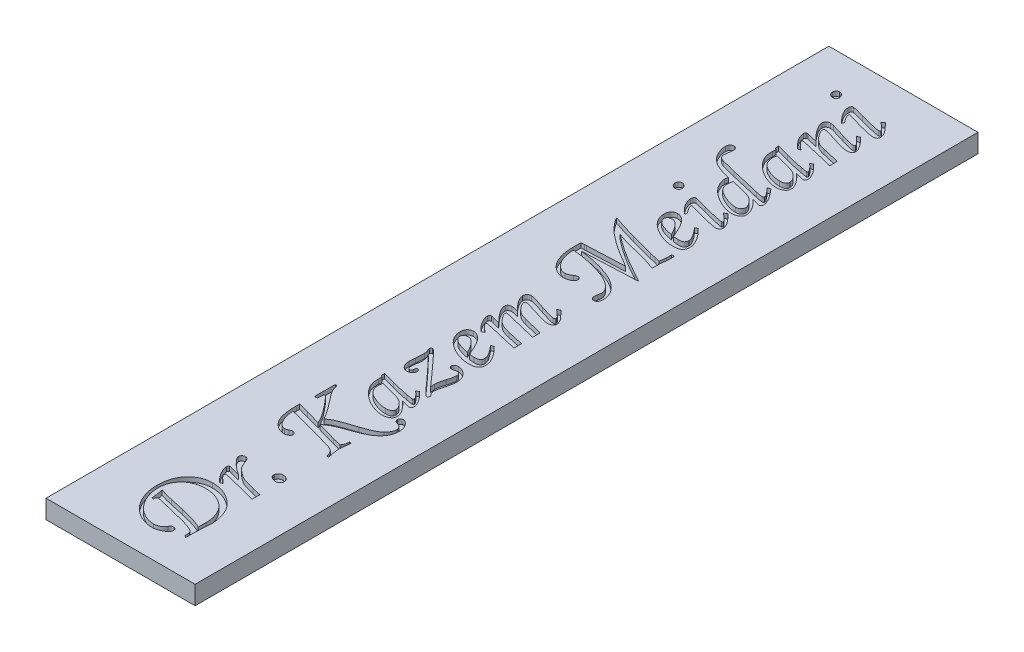
from build123d import *

# Parameters (mm, degrees)
BOSS_EXTRUDE1_DEPTH      = 66.675
BOSS_EXTRUDE1_DEPTH_BACK = 66.675
SKETCH3_W                = 25.4
SKETCH3_H                = 3.175
CUT_EXTRUDE1_DEPTH       = 0.79375


with BuildPart() as part:
    # Sketch3 → Boss-Extrude1 (new, two sides: drawn at the far end of the back side and taken through both)
    with BuildSketch(Plane.XY.offset(-BOSS_EXTRUDE1_DEPTH_BACK)):
        Rectangle(SKETCH3_W, SKETCH3_H)
    extrude(amount=BOSS_EXTRUDE1_DEPTH + BOSS_EXTRUDE1_DEPTH_BACK)

    # Sketch4 → Cut-Extrude1 (cut)
    # profile 1 of 17: a face of its own
    with BuildSketch(Plane(origin=(0, 1.5875, 0), x_dir=(1, 0, 0), z_dir=(0, 1, 0))):
        with BuildLine():
            Line((-3.408527516, -57.684680218), (-3.725830441, -57.5979177))
            add(Edge.make_bspline(
                [(-3.725830441, -57.5979177), (-3.737850592, -57.447408016), (-3.763000795, -57.132491079), (-3.827011478, -56.642375909), (-3.911149001, -56.11328112), (-3.981705302, -55.749265527), (-4.018344075, -55.560237977)],
                knots=[0, 0, 0, 0, 0.879460652, 1.84012782, 2.878412481, 4, 4, 4, 4], degree=3))
            add(Edge.make_bspline(
                [(-4.018344075, -55.560237977), (-3.852567386, -55.616552213), (-3.512771298, -55.731980729), (-2.983413328, -55.891279405), (-2.421475709, -56.036397672), (-2.03462658, -56.123204042), (-1.836886465, -56.167575607)],
                knots=[0, 0, 0, 0, 0.9271626, 1.900425364, 2.926790578, 4, 4, 4, 4], degree=3))
            Line((-1.836886465, -56.167575607), (0.577590481, -56.695587506))
            add(Edge.make_bspline(
                [(0.577590481, -56.695587506), (0.788536521, -56.742510341), (1.199033587, -56.833821303), (1.792102448, -56.983188059), (2.346957761, -57.132446642), (2.859476633, -57.292326587), (3.333976279, -57.45206802), (3.767604051, -57.617535864), (4.161898292, -57.787825475), (4.406460781, -57.912360141), (4.524045612, -57.972235994)],
                knots=[0, 0, 0, 0, 1.246806401, 2.42626203, 3.528511125, 4.561511712, 5.523423198, 6.416823405, 7.238813961, 8, 8, 8, 8], degree=3))
            add(Edge.make_bspline(
                [(4.524045612, -57.972235994), (4.524045612, -57.853247397), (4.524045612, -57.621880681), (4.524045612, -57.285572633), (4.524045612, -56.970748637), (4.524045612, -56.76830276), (4.524045612, -56.670798215)],
                knots=[0, 0, 0, 0, 1.097142857, 2.133333333, 3.100952381, 4, 4, 4, 4], degree=3))
            add(Edge.make_bspline(
                [(4.524045612, -56.670798215), (4.522291504, -56.547607351), (4.518848614, -56.305813506), (4.487231277, -55.949279002), (4.44136888, -55.604757107), (4.375193579, -55.271386025), (4.284886475, -54.951523503), (4.177549251, -54.643035144), (4.055800786, -54.344625105), (3.907414037, -54.062066281), (3.743873397, -53.791083132), (3.56312188, -53.532963965), (3.364145754, -53.289514656), (3.147852002, -53.060025769), (2.911737357, -52.847066279), (2.657510154, -52.648584986), (2.387420669, -52.462132367), (2.100574847, -52.292115148), (1.801144808, -52.13837033), (1.492341348, -52.004758998), (1.175713565, -51.893021499), (0.852102165, -51.80064363), (0.519954027, -51.729288982), (0.180693286, -51.676802539), (-0.166362662, -51.64670701), (-0.399876841, -51.642952056), (-0.518096182, -51.641051066)],
                knots=[0, 0, 0, 0, 1.108876087, 2.176455327, 3.220153502, 4.237073672, 5.233431218, 6.20981358, 7.176940925, 8.131888172, 9.079855142, 10.025132673, 10.966273431, 11.908266498, 12.861589586, 13.825966148, 14.810280397, 15.814384495, 16.825847582, 17.838841615, 18.841207958, 19.846744131, 20.866707514, 21.897815126, 22.93574381, 24, 24, 24, 24], degree=3))
            add(Edge.make_bspline(
                [(-0.518096182, -51.641051066), (-0.67114676, -51.6440818), (-0.969909313, -51.649997949), (-1.406481222, -51.705023621), (-1.821001828, -51.785336739), (-2.210609366, -51.910456971), (-2.579874473, -52.061541147), (-2.922877879, -52.255413967), (-3.245344871, -52.478956365), (-3.54122126, -52.736511852), (-3.809414774, -53.020184384), (-4.040604685, -53.32975695), (-4.23744301, -53.658677157), (-4.401048965, -54.008450311), (-4.523555491, -54.381802957), (-4.612408779, -54.775210564), (-4.669068889, -55.189233819), (-4.674806188, -55.472461433), (-4.677739217, -55.617253347)],
                knots=[0, 0, 0, 0, 1.133342806, 2.212343105, 3.255656027, 4.256658692, 5.238973399, 6.206391602, 7.169305645, 8.141419189, 9.107209001, 10.056087474, 10.997829931, 11.942750604, 12.910691636, 13.902724951, 14.927828886, 16, 16, 16, 16], degree=3))
            add(Edge.make_bspline(
                [(-4.677739217, -55.617253347), (-4.674886497, -55.741247598), (-4.669209826, -55.987985725), (-4.638083085, -56.355169214), (-4.578467951, -56.716246967), (-4.504462768, -57.073317804), (-4.399435249, -57.423788798), (-4.280777617, -57.771497719), (-4.131702221, -58.110849139), (-3.967967521, -58.444856113), (-3.781245751, -58.765656981), (-3.582011131, -59.073148101), (-3.365322185, -59.361773459), (-3.133629469, -59.63187591), (-2.89107149, -59.888326584), (-2.633457153, -60.126995889), (-2.35850353, -60.345113242), (-2.073887366, -60.54771698), (-1.781160346, -60.726083086), (-1.489336729, -60.883903565), (-1.199345173, -61.018858281), (-0.909891874, -61.127320888), (-0.623499224, -61.213155996), (-0.338947361, -61.272052613), (-0.056471082, -61.311617239), (0.132080508, -61.316412387), (0.225582548, -61.318790283)],
                knots=[0, 0, 0, 0, 1.081103213, 2.151304428, 3.208849041, 4.269895994, 5.327636848, 6.396091191, 7.470574728, 8.556204061, 9.637307273, 10.704206439, 11.748692769, 12.780810486, 13.804928832, 14.824451564, 15.839178917, 16.862460927, 17.868096616, 18.825302841, 19.753529844, 20.653949094, 21.51778112, 22.356964132, 23.185224557, 24, 24, 24, 24], degree=3))
            add(Edge.make_bspline(
                [(0.225582548, -61.318790283), (0.313291814, -61.315608297), (0.483848541, -61.309420705), (0.731848054, -61.270821529), (0.960885993, -61.199711429), (1.174699338, -61.107002101), (1.366328781, -60.980898409), (1.540483057, -60.829181696), (1.697321785, -60.651168192), (1.783302472, -60.51524205), (1.826970749, -60.446207238)],
                knots=[0, 0, 0, 0, 1.098234064, 2.135592027, 3.130352065, 4.093468783, 5.043160056, 5.989012807, 6.978650325, 8, 8, 8, 8], degree=3))
            add(Edge.make_bspline(
                [(1.826970749, -60.446207238), (1.851737867, -60.407560439), (1.897773099, -60.335726712), (1.972921894, -60.246314498), (2.036388274, -60.172594918), (2.120912859, -60.109095769), (2.238680046, -60.056550322), (2.339448541, -60.051973167), (2.392166584, -60.049578582)],
                knots=[0, 0, 0, 0, 1.132523627, 2.10504862, 2.885165995, 3.526260391, 4.70583846, 6, 6, 6, 6], degree=3))
            add(Edge.make_bspline(
                [(2.392166584, -60.049578582), (2.427050837, -60.051587902), (2.495439811, -60.055527082), (2.595113576, -60.083903241), (2.68822533, -60.132346886), (2.77293391, -60.197909879), (2.844268814, -60.276118124), (2.897436056, -60.361628739), (2.932832918, -60.453459059), (2.935952492, -60.517777388), (2.937530987, -60.550322261)],
                knots=[0, 0, 0, 0, 1.025470684, 2.010388118, 3.021353536, 4.095777109, 5.145446822, 6.116774371, 7.047093735, 8, 8, 8, 8], degree=3))
            add(Edge.make_bspline(
                [(2.937530987, -60.550322261), (2.929810836, -60.623566169), (2.913602905, -60.77733676), (2.788462926, -60.995245113), (2.59867269, -61.207699017), (2.434600287, -61.329287148), (2.345066931, -61.395637085)],
                knots=[0, 0, 0, 0, 0.817900186, 1.717125675, 2.754248756, 4, 4, 4, 4], degree=3))
            add(Edge.make_bspline(
                [(2.345066931, -61.395637085), (2.207510224, -61.480554541), (1.939582152, -61.645953748), (1.511392389, -61.822928547), (1.077285493, -61.93306818), (0.784790942, -61.946651729), (0.639563708, -61.953396133)],
                knots=[0, 0, 0, 0, 1.064484062, 2.073364277, 3.043401066, 4, 4, 4, 4], degree=3))
            add(Edge.make_bspline(
                [(0.639563708, -61.953396133), (0.517955065, -61.951499537), (0.275640518, -61.947720423), (-0.085285631, -61.902123772), (-0.443437561, -61.836381934), (-0.798884293, -61.741518532), (-1.150403836, -61.619323434), (-1.500130148, -61.473294189), (-1.843834405, -61.295320913), (-2.185113654, -61.096061186), (-2.516110901, -60.872516629), (-2.828760157, -60.622248052), (-3.126883061, -60.355006269), (-3.407974694, -60.066302083), (-3.671663482, -59.756519023), (-3.913549565, -59.422135771), (-4.143074168, -59.069955016), (-4.352287289, -58.697224325), (-4.540935034, -58.308447774), (-4.704289026, -57.906631047), (-4.84313475, -57.494326092), (-4.958312668, -57.07247633), (-5.043570711, -56.638864016), (-5.109267952, -56.195678458), (-5.146567912, -55.740193497), (-5.151299479, -55.433051067), (-5.153693604, -55.277640059)],
                knots=[0, 0, 0, 0, 0.892528231, 1.77843094, 2.667466219, 3.565321182, 4.47685171, 5.398745436, 6.345876364, 7.316869007, 8.299771953, 9.2758895, 10.255546583, 11.238224728, 12.232747284, 13.240126893, 14.266839875, 15.318322956, 16.376769289, 17.438255268, 18.501335748, 19.5700127, 20.64701274, 21.744603105, 22.858791653, 24, 24, 24, 24], degree=3))
            add(Edge.make_bspline(
                [(-5.153693604, -55.277640059), (-5.14977349, -55.089111253), (-5.142120885, -54.721076982), (-5.085781584, -54.183435901), (-4.986129604, -53.676185729), (-4.849873958, -53.198319974), (-4.677555954, -52.748290968), (-4.458934254, -52.330628824), (-4.207349884, -51.938690055), (-3.913199846, -51.583261232), (-3.593766724, -51.2615816), (-3.248487499, -50.982562765), (-2.886296789, -50.742249395), (-2.501930483, -50.547715276), (-2.096653086, -50.398039647), (-1.671801336, -50.292564878), (-1.227511505, -50.225887501), (-0.924878971, -50.217469608), (-0.770946951, -50.213187903)],
                knots=[0, 0, 0, 0, 1.203585055, 2.349564275, 3.446287516, 4.499949565, 5.518843974, 6.516943418, 7.504671405, 8.486846783, 9.456760527, 10.394399883, 11.316233178, 12.226949029, 13.138336972, 14.068555797, 15.017583784, 16, 16, 16, 16], degree=3))
            add(Edge.make_bspline(
                [(-0.770946951, -50.213187903), (-0.626223132, -50.21597851), (-0.339385663, -50.221509393), (0.085589133, -50.267771103), (0.502675673, -50.341479943), (0.90973836, -50.448976452), (1.309963128, -50.58241327), (1.698178573, -50.750096256), (2.08040968, -50.943296508), (2.44779816, -51.168607499), (2.799862341, -51.41152115), (3.128112562, -51.669451523), (3.4290476, -51.940782423), (3.704926756, -52.22312403), (3.954840911, -52.518855678), (4.174145149, -52.829843214), (4.372460873, -53.149700723), (4.59273138, -53.590530337), (4.8187842, -54.150656479), (5.012051561, -54.832239372), (5.13497266, -55.513669875), (5.150792514, -55.968763511), (5.158651463, -56.194843827)],
                knots=[0, 0, 0, 0, 0.926951201, 1.837184367, 2.735392543, 3.638035727, 4.531975, 5.435611123, 6.344735262, 7.273498627, 8.194216139, 9.083818774, 9.945937045, 10.78824293, 11.611093864, 12.42340477, 13.224180136, 14.019653575, 15.577753707, 17.085869658, 18.552325372, 20, 20, 20, 20], degree=3))
            add(Edge.make_bspline(
                [(5.158651463, -56.194843827), (5.157729345, -56.23450405), (5.155731486, -56.320431869), (5.1546833, -56.459346712), (5.145834087, -56.617942994), (5.13620562, -56.797261772), (5.123620848, -56.99639584), (5.109434914, -57.216315214), (5.088160035, -57.454880908), (5.075802571, -57.621037335), (5.069410015, -57.70699058)],
                knots=[0, 0, 0, 0, 0.628413, 1.361519305, 2.200141354, 3.144009582, 4.206244464, 5.360759236, 6.634712408, 8, 8, 8, 8], degree=3))
            add(Edge.make_bspline(
                [(5.069410015, -57.70699058), (5.049170124, -58.001868363), (5.009796502, -58.575508147), (5.003203762, -59.15045105), (5, -59.429846306)],
                knots=[0, 0, 0, 0, 1.028093904, 2, 2, 2, 2], degree=3))
            add(Edge.make_bspline(
                [(5, -59.429846306), (5, -59.500908941), (5, -59.659560403), (5, -59.922326888), (5, -60.234671955), (5, -60.459428194), (5, -60.58006941)],
                knots=[0, 0, 0, 0, 0.74137931, 1.655172414, 2.74137931, 4, 4, 4, 4], degree=3))
            Line((5, -60.58006941), (4.682697075, -60.399107586))
            add(Edge.make_bspline(
                [(4.682697075, -60.399107586), (4.675446442, -60.282533756), (4.6624123, -60.072974161), (4.63204999, -59.795340952), (4.594788937, -59.590294557), (4.550681406, -59.444763117), (4.487648725, -59.342494091), (4.416375945, -59.255083647), (4.324321365, -59.177619681), (4.255208826, -59.133231638), (4.219137333, -59.110064452)],
                knots=[0, 0, 0, 0, 1.944688049, 3.495879345, 4.645273665, 5.415328289, 6.0075428, 6.632868811, 7.286461394, 8, 8, 8, 8], degree=3))
            add(Edge.make_bspline(
                [(4.219137333, -59.110064452), (4.181438106, -59.087989249), (4.097144421, -59.038630142), (3.95084284, -58.972035543), (3.77680793, -58.896791085), (3.572629733, -58.81870402), (3.340144159, -58.731259092), (3.077750347, -58.640681329), (2.78638996, -58.542917024), (2.581525555, -58.479175768), (2.473971244, -58.445711453)],
                knots=[0, 0, 0, 0, 0.560225601, 1.252637882, 2.060094579, 2.993348988, 4.056820397, 5.24717586, 6.554760623, 8, 8, 8, 8], degree=3))
            Line((2.473971244, -58.445711453), (0.146256817, -57.855726326))
            Line((0.146256817, -57.855726326), (-2.759048091, -57.169062965))
            add(Edge.make_bspline(
                [(-2.759048091, -57.169062965), (-2.824845168, -57.153592509), (-2.944827448, -57.125381825), (-3.067879242, -57.119611425), (-3.123450669, -57.117005454)],
                knots=[0, 0, 0, 0, 1.096779889, 2, 2, 2, 2], degree=3))
            add(Edge.make_bspline(
                [(-3.123450669, -57.117005454), (-3.167468144, -57.120763803), (-3.251277883, -57.127919739), (-3.358274302, -57.197620691), (-3.426136176, -57.309422222), (-3.430796311, -57.396906869), (-3.433316807, -57.444224095)],
                knots=[0, 0, 0, 0, 1.029367958, 1.959927517, 2.89659986, 4, 4, 4, 4], degree=3))
            add(Edge.make_bspline(
                [(-3.433316807, -57.444224095), (-3.431009043, -57.473988193), (-3.424778833, -57.55434153), (-3.414806159, -57.634324289), (-3.408527516, -57.684680218)],
                knots=[0, 0, 0, 0, 0.740830417, 2, 2, 2, 2], degree=3))
        make_face()
    # profile 2 of 17: a face of its own
    with BuildSketch(Plane(origin=(0, 1.5875, 0), x_dir=(1, 0, 0), z_dir=(0, 1, 0))):
        with BuildLine():
            Line((5, -47.959841349), (5, -49.261279127))
            Line((5, -49.261279127), (2.749132375, -48.671294001))
            add(Edge.make_bspline(
                [(2.749132375, -48.671294001), (2.476621804, -48.601196091), (1.939749329, -48.463096352), (1.142714053, -48.270682356), (0.367317965, -48.088115682), (-0.144436977, -47.977277981), (-0.396628656, -47.922657412)],
                knots=[0, 0, 0, 0, 1.044120099, 2.057018701, 3.042503205, 4, 4, 4, 4], degree=3))
            add(Edge.make_bspline(
                [(-0.396628656, -47.922657412), (-0.451860919, -47.910357591), (-0.551268676, -47.88822021), (-0.684191352, -47.868377604), (-0.78209306, -47.850411922), (-0.836185817, -47.847120339), (-0.85770947, -47.84581061)],
                knots=[0, 0, 0, 0, 1.4507061, 2.611000006, 3.447313195, 4, 4, 4, 4], degree=3))
            add(Edge.make_bspline(
                [(-0.85770947, -47.84581061), (-0.882965949, -47.847863572), (-0.929877338, -47.851676746), (-0.992941333, -47.889635774), (-1.025226576, -47.9590773), (-1.027505527, -48.010797518), (-1.028755578, -48.03916708)],
                knots=[0, 0, 0, 0, 1.023146048, 1.900391694, 2.848323326, 4, 4, 4, 4], degree=3))
            add(Edge.make_bspline(
                [(-1.028755578, -48.03916708), (-1.025900082, -48.064319312), (-1.019136089, -48.123899), (-0.97085575, -48.215301317), (-0.906284825, -48.32745651), (-0.829226914, -48.429850247), (-0.749073371, -48.527623897), (-0.663675813, -48.614435461), (-0.563963289, -48.720569622), (-0.436776616, -48.832021157), (-0.297784043, -48.965122378), (-0.13501972, -49.107972888), (0.044873624, -49.267025935), (0.173300729, -49.37556791), (0.240456123, -49.432325235)],
                knots=[0, 0, 0, 0, 0.473246814, 1.121009778, 1.916259303, 2.918417322, 3.526064876, 4.296572721, 5.209868489, 6.267050422, 7.4781545, 8.833684422, 10.344312357, 12, 12, 12, 12], degree=3))
            Line((0.240456123, -49.432325235), (-0.235498265, -49.590976698))
            add(Edge.make_bspline(
                [(-0.235498265, -49.590976698), (-0.374013032, -49.454200242), (-0.642303469, -49.189276755), (-0.996377951, -48.771165767), (-1.301202587, -48.356661052), (-1.541866417, -47.94428684), (-1.730539618, -47.558325746), (-1.868611279, -47.216091708), (-1.960100433, -46.921690792), (-1.974297976, -46.738203089), (-1.980664353, -46.655924641)],
                knots=[0, 0, 0, 0, 1.341953613, 2.599241416, 3.774513272, 4.885797771, 5.887458592, 6.73406582, 7.432337434, 8, 8, 8, 8], degree=3))
            add(Edge.make_bspline(
                [(-1.980664353, -46.655924641), (-1.978954767, -46.608337281), (-1.9758845, -46.522874572), (-1.939867575, -46.413153841), (-1.881926358, -46.332770811), (-1.826688974, -46.321369739), (-1.802181458, -46.316311353)],
                knots=[0, 0, 0, 0, 1.353899392, 2.431484129, 3.304086744, 4, 4, 4, 4], degree=3))
            add(Edge.make_bspline(
                [(-1.802181458, -46.316311353), (-1.777353429, -46.318483895), (-1.713264523, -46.324091904), (-1.596651959, -46.345700884), (-1.437283458, -46.381075368), (-1.317064111, -46.411009922), (-1.249380268, -46.427863163)],
                knots=[0, 0, 0, 0, 0.529538259, 1.366903866, 2.517559208, 4, 4, 4, 4], degree=3))
            Line((-1.249380268, -46.427863163), (0.185919683, -46.79474467))
            add(Edge.make_bspline(
                [(0.185919683, -46.79474467), (-0.023585026, -46.656386625), (-0.435525148, -46.384339137), (-1.009207574, -45.931165807), (-1.540690468, -45.45784078), (-1.860052384, -45.114906506), (-2.01784829, -44.94546356)],
                knots=[0, 0, 0, 0, 1.043677459, 2.052138213, 3.037566479, 4, 4, 4, 4], degree=3))
            add(Edge.make_bspline(
                [(-2.01784829, -44.94546356), (-2.083332269, -44.867484855), (-2.204319047, -44.723413095), (-2.344669045, -44.506103536), (-2.436896974, -44.307059155), (-2.450439534, -44.176893356), (-2.456618741, -44.117501239)],
                knots=[0, 0, 0, 0, 1.279146713, 2.363323658, 3.253216489, 4, 4, 4, 4], degree=3))
            add(Edge.make_bspline(
                [(-2.456618741, -44.117501239), (-2.453883207, -44.078501764), (-2.448547746, -44.002436114), (-2.417032997, -43.89247509), (-2.355999432, -43.796951522), (-2.280416198, -43.709727357), (-2.187195464, -43.640469757), (-2.086235253, -43.585189776), (-1.975685467, -43.555708028), (-1.89983507, -43.551795045), (-1.861675756, -43.549826475)],
                knots=[0, 0, 0, 0, 1.02716901, 2.003418691, 2.968722159, 3.984796309, 5.023623781, 6.005421064, 6.99655419, 8, 8, 8, 8], degree=3))
            add(Edge.make_bspline(
                [(-1.861675756, -43.549826475), (-1.821869499, -43.55175628), (-1.743574198, -43.555552031), (-1.630400641, -43.584733815), (-1.529097993, -43.639879945), (-1.42974173, -43.715948144), (-1.334766273, -43.83747784), (-1.237717657, -44.012026173), (-1.132199974, -44.246383077), (-1.065565718, -44.425240869), (-1.028755578, -44.524045612)],
                knots=[0, 0, 0, 0, 0.693177916, 1.363418161, 2.013581126, 2.690126397, 3.528536773, 4.676329381, 6.163935612, 8, 8, 8, 8], degree=3))
            add(Edge.make_bspline(
                [(-1.028755578, -44.524045612), (-0.992147421, -44.622944697), (-0.921649995, -44.813397635), (-0.797260717, -45.079425298), (-0.66338313, -45.317298839), (-0.512948419, -45.533719355), (-0.331526013, -45.736096403), (-0.120645105, -45.946064404), (0.135324987, -46.159742153), (0.41635967, -46.380088288), (0.706643548, -46.585762555), (0.981437412, -46.765448493), (1.23170012, -46.910494458), (1.433299647, -47.009339897), (1.604863375, -47.078100109), (1.765135114, -47.130767888), (1.960313587, -47.190626125), (2.190286229, -47.256742856), (2.455895435, -47.332027781), (2.757035257, -47.41011314), (3.093482934, -47.494685832), (3.329172568, -47.552587257), (3.45314824, -47.583044125)],
                knots=[0, 0, 0, 0, 1.110708496, 2.138924714, 3.090259246, 3.983917359, 4.909365599, 5.949746143, 7.116886804, 8.419515261, 9.711892046, 10.863736856, 11.877701499, 12.757685161, 13.226511401, 13.823927962, 14.534404968, 15.377483492, 16.344934113, 17.442980541, 18.654976029, 20, 20, 20, 20], degree=3))
            Line((3.45314824, -47.583044125), (5, -47.959841349))
        make_face()
    # profile 3 of 17: a face of its own
    with BuildSketch(Plane(origin=(0, 1.5875, 0), x_dir=(1, 0, 0), z_dir=(0, 1, 0))):
        with BuildLine():
            add(Edge.make_bspline(
                [(3.254833912, -43.800198314), (3.257621138, -43.75027599), (3.263025186, -43.653483459), (3.307683108, -43.514629766), (3.380155069, -43.388525868), (3.483912564, -43.280245084), (3.606712714, -43.188672842), (3.747767046, -43.120629387), (3.90452123, -43.079797485), (4.013962432, -43.075888145), (4.070401587, -43.073872087)],
                knots=[0, 0, 0, 0, 0.98159276, 1.903173577, 2.844104295, 3.823129028, 4.835684381, 5.847716179, 6.890060819, 8, 8, 8, 8], degree=3))
            add(Edge.make_bspline(
                [(4.070401587, -43.073872087), (4.150830493, -43.076157721), (4.304147742, -43.0805147), (4.520286408, -43.128672002), (4.710166176, -43.205026966), (4.869846914, -43.312251746), (4.998426406, -43.44212348), (5.092250042, -43.59066665), (5.150185462, -43.757250546), (5.155780282, -43.874096716), (5.158651463, -43.934060486)],
                knots=[0, 0, 0, 0, 1.24009155, 2.36391907, 3.399451324, 4.383300886, 5.312685463, 6.201320917, 7.07694382, 8, 8, 8, 8], degree=3))
            add(Edge.make_bspline(
                [(5.158651463, -43.934060486), (5.156991741, -43.98403733), (5.153771406, -44.081006706), (5.107487951, -44.218458261), (5.040636139, -44.344916175), (4.945762364, -44.456176093), (4.830364042, -44.547464373), (4.697014964, -44.613610767), (4.548772793, -44.654561178), (4.444167504, -44.658403692), (4.390183441, -44.660386713)],
                knots=[0, 0, 0, 0, 1.010157701, 1.959994936, 2.913381871, 3.901564746, 4.905152474, 5.880576668, 6.906220855, 8, 8, 8, 8], degree=3))
            add(Edge.make_bspline(
                [(4.390183441, -44.660386713), (4.310399291, -44.657779163), (4.153618082, -44.652655152), (3.928962128, -44.590475796), (3.714939161, -44.504624838), (3.591982139, -44.413707705), (3.529995042, -44.367873079)],
                knots=[0, 0, 0, 0, 1.030978626, 2.025942206, 3.004805837, 4, 4, 4, 4], degree=3))
            add(Edge.make_bspline(
                [(3.529995042, -44.367873079), (3.487337518, -44.330983224), (3.405119037, -44.2598814), (3.318447451, -44.12133723), (3.263752641, -43.967020447), (3.257863637, -43.856868413), (3.254833912, -43.800198314)],
                knots=[0, 0, 0, 0, 1.029763566, 1.984775184, 2.963223966, 4, 4, 4, 4], degree=3))
        make_face()
    # profile 4 of 17: a face of its own
    with BuildSketch(Plane(origin=(0, 1.5875, 0), x_dir=(1, 0, 0), z_dir=(0, 1, 0))):
        with BuildLine():
            Line((-4.836390679, -25.252850768), (-4.519087754, -25.30490828))
            add(Edge.make_bspline(
                [(-4.519087754, -25.30490828), (-4.492135599, -25.415934883), (-4.440085334, -25.630350538), (-4.34666095, -25.934473791), (-4.242648, -26.208726325), (-4.123682365, -26.465111672), (-3.971363541, -26.723230121), (-3.777685884, -27.009137752), (-3.537276841, -27.335980714), (-3.354920278, -27.563108642), (-3.257312841, -27.684680218)],
                knots=[0, 0, 0, 0, 1.005923717, 1.942649652, 2.799403876, 3.587130973, 4.428294073, 5.435322479, 6.627241073, 8, 8, 8, 8], degree=3))
            add(Edge.make_bspline(
                [(-3.257312841, -27.684680218), (-3.12323067, -27.855552787), (-2.861104641, -28.189602777), (-2.480152413, -28.682720331), (-2.126357728, -29.160959793), (-1.795654008, -29.622839135), (-1.489409066, -30.067711134), (-1.20514014, -30.494763197), (-0.947085269, -30.905520023), (-0.788443512, -31.177082061), (-0.711452652, -31.308874566)],
                knots=[0, 0, 0, 0, 1.175917022, 2.298877293, 3.373460456, 4.396395856, 5.374228529, 6.297357712, 7.173686079, 8, 8, 8, 8], degree=3))
            add(Edge.make_bspline(
                [(-0.711452652, -31.308874566), (-0.621419548, -31.239104814), (-0.440419399, -31.098841567), (-0.151435891, -30.908817676), (0.151361473, -30.731647122), (0.424543455, -30.5956122), (0.678094759, -30.488058615), (0.921361032, -30.392092536), (1.217285877, -30.27924499), (1.568155782, -30.158112621), (1.970939453, -30.017983318), (2.426124602, -29.864704947), (2.935479754, -29.698816563), (3.292796699, -29.584218626), (3.48041646, -29.524045612)],
                knots=[0, 0, 0, 0, 0.894373608, 1.798024809, 2.714175878, 3.648808406, 4.192527531, 4.877097648, 5.702826949, 6.679920639, 7.792404767, 9.052602235, 10.452382196, 12, 12, 12, 12], degree=3))
            add(Edge.make_bspline(
                [(3.48041646, -29.524045612), (3.649324586, -29.468858014), (3.973791812, -29.362844364), (4.436921873, -29.193733566), (4.857180472, -29.02390059), (5.234716476, -28.853524225), (5.569552989, -28.682311916), (5.861408165, -28.51006198), (6.112733756, -28.338012335), (6.256206866, -28.212353065), (6.323748141, -28.153197819)],
                knots=[0, 0, 0, 0, 1.341831923, 2.577617158, 3.722478034, 4.764120629, 5.704633398, 6.56077414, 7.322471309, 8, 8, 8, 8], degree=3))
            add(Edge.make_bspline(
                [(6.323748141, -28.153197819), (6.382642709, -28.095512558), (6.496446108, -27.984045932), (6.645052181, -27.805626007), (6.775359335, -27.631038233), (6.881246886, -27.453771701), (6.960576569, -27.274347923), (7.018176505, -27.094941829), (7.05482692, -26.914380591), (7.059923707, -26.793258928), (7.062469013, -26.732771443)],
                knots=[0, 0, 0, 0, 1.201161364, 2.321033193, 3.381255723, 4.375058903, 5.324268612, 6.234849288, 7.118493537, 8, 8, 8, 8], degree=3))
            add(Edge.make_bspline(
                [(7.062469013, -26.732771443), (7.060097126, -26.676387205), (7.055514156, -26.567441363), (7.020060101, -26.411623308), (6.962506807, -26.269418963), (6.879753003, -26.141063323), (6.7703373, -26.028999894), (6.640426072, -25.929246651), (6.486899326, -25.843544486), (6.37320326, -25.80236575), (6.313832424, -25.780862667)],
                knots=[0, 0, 0, 0, 1.034980503, 1.999793351, 2.918738068, 3.840811649, 4.785594939, 5.781432555, 6.84148847, 8, 8, 8, 8], degree=3))
            add(Edge.make_bspline(
                [(6.313832424, -25.780862667), (6.247202395, -25.757239216), (6.125777466, -25.714188417), (5.970516877, -25.641140955), (5.849786758, -25.583890117), (5.794197936, -25.534004039), (5.770946951, -25.513138324)],
                knots=[0, 0, 0, 0, 1.390957009, 2.534845896, 3.387173972, 4, 4, 4, 4], degree=3))
            add(Edge.make_bspline(
                [(5.770946951, -25.513138324), (5.731501044, -25.460778353), (5.654318996, -25.358327929), (5.641079134, -25.230879669), (5.63460585, -25.168567179)],
                knots=[0, 0, 0, 0, 1.022152363, 2, 2, 2, 2], degree=3))
            add(Edge.make_bspline(
                [(5.63460585, -25.168567179), (5.635490819, -25.135268655), (5.637227403, -25.06992662), (5.667108513, -24.977245179), (5.708977239, -24.890708684), (5.76901213, -24.815130295), (5.839436933, -24.749216961), (5.922321297, -24.706034297), (6.010158881, -24.675669145), (6.071451476, -24.672130809), (6.103123451, -24.670302429)],
                knots=[0, 0, 0, 0, 1.047270876, 2.055070375, 3.047534753, 4.071105671, 5.087995244, 6.069408874, 7.002397722, 8, 8, 8, 8], degree=3))
            add(Edge.make_bspline(
                [(6.103123451, -24.670302429), (6.186934625, -24.677899958), (6.360879916, -24.693668192), (6.611229787, -24.816336897), (6.853353253, -25.006883564), (7.081506771, -25.264332638), (7.288985445, -25.574138951), (7.43391674, -25.937147605), (7.522781029, -26.338474753), (7.53307173, -26.619072756), (7.538423401, -26.764997521)],
                knots=[0, 0, 0, 0, 0.722776895, 1.500082036, 2.366471301, 3.378586138, 4.463028304, 5.575356058, 6.739065879, 8, 8, 8, 8], degree=3))
            add(Edge.make_bspline(
                [(7.538423401, -26.764997521), (7.533367097, -26.894189391), (7.52327377, -27.152080505), (7.45060103, -27.533920416), (7.322972599, -27.903848443), (7.152900617, -28.265439679), (6.92653682, -28.612629778), (6.645834893, -28.944566783), (6.307715706, -29.259636758), (5.984207053, -29.506922344), (5.690202142, -29.699123455), (5.438502642, -29.847519539), (5.156050664, -29.993192842), (4.84590694, -30.141637356), (4.507735434, -30.293094226), (4.138716686, -30.440656908), (3.743338138, -30.592418013), (3.468276876, -30.689011323), (3.326722856, -30.738720873)],
                knots=[0, 0, 0, 0, 0.997573073, 1.991342271, 2.988261947, 4.01302073, 5.069768413, 6.179378208, 7.362197271, 8.632200043, 9.318956404, 10.0741455, 10.887643224, 11.772479327, 12.729506761, 13.748646673, 14.841392228, 16, 16, 16, 16], degree=3))
            add(Edge.make_bspline(
                [(3.326722856, -30.738720873), (3.194535544, -30.785055719), (2.940023359, -30.874268388), (2.573897131, -31.001496874), (2.241096162, -31.123596786), (1.940862495, -31.236993508), (1.673736685, -31.344308289), (1.43797838, -31.439325521), (1.235889091, -31.529584586), (1.005176657, -31.638686253), (0.736504222, -31.78842169), (0.414923491, -31.986513681), (0.087778286, -32.21860894), (-0.128803721, -32.388742754), (-0.240456123, -32.476450174)],
                knots=[0, 0, 0, 0, 1.262450208, 2.430709543, 3.493280617, 4.457329899, 5.323048979, 6.087843881, 6.747973893, 7.317585766, 8.387439442, 9.517890495, 10.720422387, 12, 12, 12, 12], degree=3))
            Line((-0.240456123, -32.476450174), (3.036688151, -33.408527516))
            add(Edge.make_bspline(
                [(3.036688151, -33.408527516), (3.116898429, -33.430622286), (3.27075236, -33.473002979), (3.491881908, -33.537605549), (3.697011769, -33.587456061), (3.883600473, -33.635141331), (4.051826409, -33.677902724), (4.203077992, -33.712581573), (4.336877376, -33.740504304), (4.420708881, -33.754188256), (4.459593456, -33.760535449)],
                knots=[0, 0, 0, 0, 1.361608383, 2.61174512, 3.769530498, 4.81580208, 5.763673558, 6.610029132, 7.355273099, 8, 8, 8, 8], degree=3))
            add(Edge.make_bspline(
                [(4.459593456, -33.760535449), (4.519497302, -33.677564441), (4.63246805, -33.52109207), (4.761168341, -33.279904831), (4.842049373, -33.049205673), (4.85335999, -32.897579465), (4.858701041, -32.825979177)],
                knots=[0, 0, 0, 0, 1.187666578, 2.239782421, 3.168797491, 4, 4, 4, 4], degree=3))
            add(Edge.make_bspline(
                [(4.858701041, -32.825979177), (4.857360816, -32.785471617), (4.854238971, -32.691115632), (4.846032133, -32.597058902), (4.841348537, -32.543381259)],
                knots=[0, 0, 0, 0, 0.85861135, 2, 2, 2, 2], degree=3))
            Line((4.841348537, -32.543381259), (5.158651463, -32.543381259))
            add(Edge.make_bspline(
                [(5.158651463, -32.543381259), (5.160357142, -32.588000116), (5.163010298, -32.657404001), (5.165278313, -32.726821437), (5.16608825, -32.751611304)],
                knots=[0, 0, 0, 0, 1.285774049, 2, 2, 2, 2], degree=3))
            add(Edge.make_bspline(
                [(5.16608825, -32.751611304), (5.164931829, -32.80203928), (5.162406458, -32.912163039), (5.146593049, -33.092560558), (5.118088378, -33.301330848), (5.096007298, -33.450692891), (5.084283589, -33.529995042)],
                knots=[0, 0, 0, 0, 0.772550633, 1.687082968, 2.771981885, 4, 4, 4, 4], degree=3))
            add(Edge.make_bspline(
                [(5.084283589, -33.529995042), (5.071017811, -33.614170228), (5.045716488, -33.77471441), (5.023231097, -34.004949948), (5.002665741, -34.210518773), (5.000848801, -34.339734672), (5, -34.400099157)],
                knots=[0, 0, 0, 0, 1.168386779, 2.228420396, 3.172389061, 4, 4, 4, 4], degree=3))
            add(Edge.make_bspline(
                [(5, -34.400099157), (5.001063725, -34.462097588), (5.003321432, -34.593686436), (5.019666242, -34.803667513), (5.044443372, -35.038423297), (5.079589178, -35.298744242), (5.124395383, -35.58385217), (5.179551908, -35.894477761), (5.243360045, -36.230125157), (5.292110406, -36.461823163), (5.317302925, -36.581556767)],
                knots=[0, 0, 0, 0, 0.673980388, 1.430492697, 2.288612791, 3.240197415, 4.285844802, 5.42600513, 6.669847497, 8, 8, 8, 8], degree=3))
            Line((5.317302925, -36.581556767), (5, -36.534457115))
            add(Edge.make_bspline(
                [(5, -36.534457115), (4.970316771, -36.416336298), (4.914916642, -36.195878193), (4.800380027, -35.899303849), (4.674597111, -35.654874455), (4.518132779, -35.463488927), (4.329837723, -35.312285932), (4.1044041, -35.18308231), (3.835121172, -35.069793829), (3.637269404, -35.011202451), (3.532473971, -34.980168567)],
                knots=[0, 0, 0, 0, 1.274604155, 2.378893288, 3.3238975, 4.141791511, 4.947503638, 5.839699256, 6.855761294, 8, 8, 8, 8], degree=3))
            add(Edge.make_bspline(
                [(3.532473971, -34.980168567), (3.411143894, -34.940891189), (3.154270921, -34.857735411), (2.745227924, -34.735636378), (2.294593066, -34.600780585), (1.799982334, -34.460250809), (1.263178834, -34.308782788), (0.68231503, -34.149938052), (0.057956233, -33.984857069), (-0.372660595, -33.871241028), (-0.594942985, -33.81259296)],
                knots=[0, 0, 0, 0, 0.713438991, 1.510451479, 2.388051422, 3.344980184, 4.387006753, 5.508469388, 6.71388357, 8, 8, 8, 8], degree=3))
            Line((-0.594942985, -33.81259296), (-4.519087754, -32.781358453))
            add(Edge.make_bspline(
                [(-4.519087754, -32.781358453), (-4.508988752, -32.913723875), (-4.489241432, -33.172547706), (-4.435679923, -33.548688751), (-4.371186507, -33.904595279), (-4.283147948, -34.23788117), (-4.180375578, -34.550741041), (-4.057859051, -34.840821812), (-3.923148768, -35.112444841), (-3.814283966, -35.277803946), (-3.760535449, -35.35944472)],
                knots=[0, 0, 0, 0, 1.171140172, 2.290016387, 3.351162448, 4.361039066, 5.329499727, 6.254433668, 7.138182412, 8, 8, 8, 8], degree=3))
            add(Edge.make_bspline(
                [(-3.760535449, -35.35944472), (-3.719279526, -35.417134403), (-3.63984707, -35.528207746), (-3.510419165, -35.678350705), (-3.376196977, -35.805854851), (-3.237854364, -35.91088402), (-3.094927413, -35.991179624), (-2.949268007, -36.049414935), (-2.799615687, -36.085441679), (-2.698090571, -36.090624776), (-2.647496282, -36.093207734)],
                knots=[0, 0, 0, 0, 1.225624535, 2.359767079, 3.420756446, 4.420658775, 5.354398823, 6.245653335, 7.125734328, 8, 8, 8, 8], degree=3))
            add(Edge.make_bspline(
                [(-2.647496282, -36.093207734), (-2.608469645, -36.091194771), (-2.524292934, -36.086853002), (-2.392587769, -36.05070092), (-2.245808547, -35.998841155), (-2.145549158, -35.952023919), (-2.092216163, -35.927119484)],
                knots=[0, 0, 0, 0, 0.80104221, 1.727771182, 2.791287575, 4, 4, 4, 4], degree=3))
            add(Edge.make_bspline(
                [(-2.092216163, -35.927119484), (-2.043801384, -35.90403456), (-1.954076897, -35.86125252), (-1.823461501, -35.812481138), (-1.707557217, -35.783791253), (-1.634558109, -35.778368735), (-1.6013882, -35.775904809)],
                knots=[0, 0, 0, 0, 1.243495424, 2.304502751, 3.229586611, 4, 4, 4, 4], degree=3))
            add(Edge.make_bspline(
                [(-1.6013882, -35.775904809), (-1.564018658, -35.777844443), (-1.491535651, -35.78160661), (-1.386300147, -35.810274693), (-1.288382767, -35.857711358), (-1.200929753, -35.925036845), (-1.124833963, -36.001578075), (-1.067953251, -36.087919045), (-1.03363915, -36.182429985), (-1.030396801, -36.248276116), (-1.028755578, -36.281606346)],
                knots=[0, 0, 0, 0, 1.061510566, 2.058935482, 3.078260371, 4.135602004, 5.182448671, 6.133983618, 7.055453164, 8, 8, 8, 8], degree=3))
            add(Edge.make_bspline(
                [(-1.028755578, -36.281606346), (-1.032571523, -36.320038035), (-1.040318021, -36.39805567), (-1.090272638, -36.511430853), (-1.176826843, -36.613628509), (-1.289052517, -36.70895194), (-1.429159187, -36.788598471), (-1.592221126, -36.844557668), (-1.775901297, -36.879840552), (-1.905296162, -36.884184503), (-1.973227566, -36.886465047)],
                knots=[0, 0, 0, 0, 0.748477498, 1.519434745, 2.366057004, 3.336168047, 4.373688014, 5.482810184, 6.678492866, 8, 8, 8, 8], degree=3))
            add(Edge.make_bspline(
                [(-1.973227566, -36.886465047), (-2.069371019, -36.883477012), (-2.259944757, -36.877554184), (-2.541110319, -36.819136953), (-2.815638628, -36.730627355), (-3.082698875, -36.602303946), (-3.341191969, -36.437012833), (-3.59237317, -36.23632071), (-3.838515654, -36.00295437), (-4.075600065, -35.731437162), (-4.29767558, -35.415020862), (-4.483160323, -35.041066108), (-4.645677534, -34.617525896), (-4.771046716, -34.138896266), (-4.871758643, -33.609600511), (-4.946129106, -33.027748771), (-4.98642686, -32.391918039), (-4.992094405, -31.950146057), (-4.995042142, -31.720376797)],
                knots=[0, 0, 0, 0, 0.691758742, 1.371191116, 2.06015258, 2.765731381, 3.498942055, 4.265905185, 5.078539888, 5.939222114, 6.858953191, 7.854606022, 8.937997226, 10.12207277, 11.413253916, 12.817565108, 14.344789303, 16, 16, 16, 16], degree=3))
            Line((-4.995042142, -31.720376797), (-4.995042142, -31.177491324))
            add(Edge.make_bspline(
                [(-4.995042142, -31.177491324), (-4.89434673, -31.208452919), (-4.699912098, -31.268237235), (-4.418142268, -31.348058494), (-4.159564482, -31.424756534), (-3.920624096, -31.487390498), (-3.704860831, -31.547971732), (-3.509547347, -31.597248124), (-3.337246288, -31.640417081), (-3.228466091, -31.662861779), (-3.17798711, -31.673277144)],
                knots=[0, 0, 0, 0, 1.341956257, 2.591208153, 3.730568953, 4.777489313, 5.737626421, 6.585230611, 7.343482371, 8, 8, 8, 8], degree=3))
            Line((-3.17798711, -31.673277144), (-0.669310858, -32.357461577))
            add(Edge.make_bspline(
                [(-0.669310858, -32.357461577), (-0.713306832, -32.249390752), (-0.806507352, -32.020454874), (-0.984618736, -31.672595847), (-1.201896865, -31.298912109), (-1.547578578, -30.769875721), (-2.018963031, -30.102028551), (-2.430076529, -29.587358573), (-2.635101636, -29.330689142)],
                knots=[0, 0, 0, 0, 0.579645595, 1.227913948, 1.93998424, 2.72705761, 4.367761295, 6, 6, 6, 6], degree=3))
            add(Edge.make_bspline(
                [(-2.635101636, -29.330689142), (-2.725847224, -29.220666904), (-2.89757708, -29.012457296), (-3.142791899, -28.719759346), (-3.360888757, -28.465072664), (-3.548626621, -28.24719613), (-3.707290891, -28.066294359), (-3.841106168, -27.926453487), (-3.943852124, -27.820751407), (-4.005711237, -27.766232313), (-4.030738721, -27.744174517)],
                knots=[0, 0, 0, 0, 1.618745544, 3.063365915, 4.333952179, 5.424485575, 6.3279782, 7.064383939, 7.621460533, 8, 8, 8, 8], degree=3))
            add(Edge.make_bspline(
                [(-4.030738721, -27.744174517), (-4.055423759, -27.726946769), (-4.098483582, -27.696895217), (-4.150038016, -27.688333663), (-4.17203768, -27.684680218)],
                knots=[0, 0, 0, 0, 1.146546227, 2, 2, 2, 2], degree=3))
            add(Edge.make_bspline(
                [(-4.17203768, -27.684680218), (-4.18341339, -27.686905748), (-4.2095858, -27.692026085), (-4.23814639, -27.731501906), (-4.268331084, -27.783457427), (-4.297488286, -27.867193752), (-4.322339023, -27.998269629), (-4.334421359, -28.196989274), (-4.354588407, -28.470162624), (-4.358339133, -28.678661619), (-4.360436292, -28.795240456)],
                knots=[0, 0, 0, 0, 0.231993242, 0.533753219, 0.94629449, 1.491301816, 2.344296482, 3.697037914, 5.594068439, 8, 8, 8, 8], degree=3))
            Line((-4.360436292, -28.795240456), (-4.836390679, -28.795240456))
            add(Edge.make_bspline(
                [(-4.836390679, -28.795240456), (-4.836390679, -28.616757561), (-4.836390679, -28.276317964), (-4.836390679, -27.79044786), (-4.836390679, -27.354982647), (-4.836390679, -27.081474137), (-4.836390679, -26.953396133)],
                knots=[0, 0, 0, 0, 1.162853297, 2.218034993, 3.165545087, 4, 4, 4, 4], degree=3))
            add(Edge.make_bspline(
                [(-4.836390679, -26.953396133), (-4.836390679, -26.826144439), (-4.836390679, -26.561725335), (-4.836390679, -26.151049413), (-4.836390679, -25.711452652), (-4.836390679, -25.409023302), (-4.836390679, -25.252850768)],
                knots=[0, 0, 0, 0, 0.897959184, 1.865889213, 2.897959184, 4, 4, 4, 4], degree=3))
        make_face()
    # profile 5 of 17: a face of its own
    with BuildSketch(Plane(origin=(0, 1.5875, 0), x_dir=(1, 0, 0), z_dir=(0, 1, 0))):
        with BuildLine():
            Line((-2.206246901, -20.017352504), (-2.283093704, -19.41993059))
            Line((-2.283093704, -19.41993059), (-0.171046108, -20))
            add(Edge.make_bspline(
                [(-0.171046108, -20), (0.046872586, -20.057900843), (0.498011026, -20.177768008), (1.200372725, -20.345574389), (1.951277439, -20.506228882), (2.46802553, -20.607314778), (2.7342588, -20.659395141)],
                knots=[0, 0, 0, 0, 0.90796384, 1.879679904, 2.90759199, 4, 4, 4, 4], degree=3))
            add(Edge.make_bspline(
                [(2.7342588, -20.659395141), (2.805308501, -20.672681883), (2.940723915, -20.698005418), (3.134826781, -20.733239585), (3.30933261, -20.762022017), (3.463475787, -20.78870226), (3.5978482, -20.804085254), (3.711454489, -20.820970586), (3.805879347, -20.828365034), (3.862164533, -20.829806302), (3.886960833, -20.830441249)],
                knots=[0, 0, 0, 0, 1.487344639, 2.834767631, 4.05909769, 5.126904251, 6.052745403, 6.841506106, 7.489628368, 8, 8, 8, 8], degree=3))
            add(Edge.make_bspline(
                [(3.886960833, -20.830441249), (3.910598327, -20.828288726), (3.955210576, -20.824226158), (4.013443822, -20.786831721), (4.04465547, -20.721269056), (4.046855527, -20.672124443), (4.048091225, -20.644521567)],
                knots=[0, 0, 0, 0, 1.008028429, 1.902503488, 2.821906775, 4, 4, 4, 4], degree=3))
            add(Edge.make_bspline(
                [(4.048091225, -20.644521567), (4.045207053, -20.621009293), (4.038512537, -20.566434427), (3.991563257, -20.481639186), (3.928377217, -20.377664796), (3.872932163, -20.305218164), (3.842340109, -20.265245414)],
                knots=[0, 0, 0, 0, 0.645627377, 1.498580228, 2.619830575, 4, 4, 4, 4], degree=3))
            add(Edge.make_bspline(
                [(3.842340109, -20.265245414), (3.779107781, -20.187309771), (3.650665451, -20.029000944), (3.431336373, -19.80770199), (3.197722354, -19.584106476), (3.02545935, -19.447511232), (2.937530987, -19.377788795)],
                knots=[0, 0, 0, 0, 0.94743365, 1.924499538, 2.940600381, 4, 4, 4, 4], degree=3))
            Line((2.937530987, -19.377788795), (3.413485374, -19.117501239))
            add(Edge.make_bspline(
                [(3.413485374, -19.117501239), (3.483876616, -19.190895437), (3.617797209, -19.330529208), (3.805582586, -19.531088778), (3.972147134, -19.710710916), (4.119022656, -19.867332083), (4.239702709, -20.00753121), (4.341973112, -20.124279646), (4.423993102, -20.218687199), (4.468103129, -20.277442605), (4.486861676, -20.302429351)],
                knots=[0, 0, 0, 0, 1.525942239, 2.903132367, 4.122598412, 5.20188744, 6.124514908, 6.897843236, 7.531288906, 8, 8, 8, 8], degree=3))
            add(Edge.make_bspline(
                [(4.486861676, -20.302429351), (4.546870395, -20.386666916), (4.663231521, -20.550009477), (4.810946161, -20.802697797), (4.939540027, -21.046504237), (5.007015779, -21.211629019), (5.039662866, -21.291522062)],
                knots=[0, 0, 0, 0, 1.091788025, 2.117053737, 3.088965904, 4, 4, 4, 4], degree=3))
            add(Edge.make_bspline(
                [(5.039662866, -21.291522062), (5.074360642, -21.391362771), (5.141955268, -21.585862135), (5.153185803, -21.791394652), (5.158651463, -21.891422905)],
                knots=[0, 0, 0, 0, 1.026643037, 2, 2, 2, 2], degree=3))
            add(Edge.make_bspline(
                [(5.158651463, -21.891422905), (5.155350208, -21.953539874), (5.149296211, -22.067452909), (5.069075024, -22.21631296), (4.927285095, -22.300685978), (4.820173206, -22.30856395), (4.762022806, -22.312840853)],
                knots=[0, 0, 0, 0, 1.124419335, 2.062013343, 2.947878707, 4, 4, 4, 4], degree=3))
            add(Edge.make_bspline(
                [(4.762022806, -22.312840853), (4.712229375, -22.308274245), (4.594657657, -22.297491618), (4.480679428, -22.266344519), (4.414972732, -22.248388696)],
                knots=[0, 0, 0, 0, 0.847030763, 2, 2, 2, 2], degree=3))
            Line((4.414972732, -22.248388696), (3.292017848, -21.923648984))
            add(Edge.make_bspline(
                [(3.292017848, -21.923648984), (3.43301964, -22.044429202), (3.71569274, -22.286563135), (4.101644644, -22.693560006), (4.45852805, -23.132742162), (4.668626578, -23.448066592), (4.774417452, -23.606841844)],
                knots=[0, 0, 0, 0, 0.988676747, 1.982048, 2.983900998, 4, 4, 4, 4], degree=3))
            add(Edge.make_bspline(
                [(4.774417452, -23.606841844), (4.833228156, -23.70297493), (4.945054951, -23.885769113), (5.064766213, -24.169534724), (5.142116986, -24.440636572), (5.153300398, -24.619448906), (5.158651463, -24.705007437)],
                knots=[0, 0, 0, 0, 1.146294369, 2.17964442, 3.128992139, 4, 4, 4, 4], degree=3))
            add(Edge.make_bspline(
                [(5.158651463, -24.705007437), (5.154558741, -24.779915364), (5.146659721, -24.924488908), (5.080527699, -25.126877137), (4.97184246, -25.304357453), (4.867312016, -25.391774666), (4.814080317, -25.436291522)],
                knots=[0, 0, 0, 0, 1.068790413, 2.062783273, 3.013480346, 4, 4, 4, 4], degree=3))
            add(Edge.make_bspline(
                [(4.814080317, -25.436291522), (4.733291496, -25.490226332), (4.567824274, -25.600692643), (4.275698138, -25.702961319), (3.952804098, -25.769254876), (3.725386167, -25.776885246), (3.606841844, -25.780862667)],
                knots=[0, 0, 0, 0, 0.910170709, 1.8641616, 2.886668627, 4, 4, 4, 4], degree=3))
            add(Edge.make_bspline(
                [(3.606841844, -25.780862667), (3.45359616, -25.774635827), (3.137397688, -25.761787718), (2.652615344, -25.668427973), (2.143595166, -25.523738508), (1.6174608, -25.323847489), (1.089939546, -25.077463578), (0.582699244, -24.783507635), (0.097413895, -24.454762204), (-0.35534899, -24.090045009), (-0.766669526, -23.699428121), (-1.125501191, -23.295012718), (-1.428990704, -22.881036121), (-1.58481846, -22.587505089), (-1.660882499, -22.444224095)],
                knots=[0, 0, 0, 0, 0.8486497, 1.751055754, 2.726315549, 3.778045861, 4.865434137, 5.948216513, 7.022362023, 8.109750299, 9.165299167, 10.160930458, 11.10229692, 12, 12, 12, 12], degree=3))
            add(Edge.make_bspline(
                [(-1.660882499, -22.444224095), (-1.710274825, -22.327142009), (-1.813412159, -22.082660017), (-1.911243962, -21.676804229), (-1.970643487, -21.225568481), (-1.977223348, -20.909151957), (-1.980664353, -20.743678731)],
                knots=[0, 0, 0, 0, 0.873292068, 1.823542698, 2.861799613, 4, 4, 4, 4], degree=3))
            add(Edge.make_bspline(
                [(-1.980664353, -20.743678731), (-1.978539842, -20.656013019), (-1.974243023, -20.478709255), (-1.955456898, -20.302348968), (-1.945959346, -20.213187903)],
                knots=[0, 0, 0, 0, 0.988875926, 2, 2, 2, 2], degree=3))
            Line((-1.945959346, -20.213187903), (-2.206246901, -20.017352504))
        make_face()
        with BuildLine():
            add(Edge.make_bspline(
                [(-0.937035201, -21.023797719), (-0.950711815, -21.093953047), (-0.976867235, -21.228119453), (-1.007148043, -21.421426031), (-1.025914188, -21.597703929), (-1.027843182, -21.709595162), (-1.028755578, -21.762518592)],
                knots=[0, 0, 0, 0, 1.150223668, 2.19970997, 3.148480886, 4, 4, 4, 4], degree=3))
            add(Edge.make_bspline(
                [(-1.028755578, -21.762518592), (-1.02439797, -21.880280026), (-1.015859893, -22.111015827), (-0.936541332, -22.445723885), (-0.805201428, -22.756100882), (-0.65744751, -22.99825045), (-0.50415092, -23.175249382), (-0.371222828, -23.30929781), (-0.215781906, -23.438003865), (-0.040640265, -23.564754857), (0.153867142, -23.691119819), (0.371555534, -23.81124867), (0.605936316, -23.933726906), (0.945067393, -24.086956332), (1.382099731, -24.256009869), (1.916619834, -24.402908668), (2.451860678, -24.493784782), (2.809108964, -24.505709447), (2.987109569, -24.511650967)],
                knots=[0, 0, 0, 0, 1.052938798, 2.063075052, 3.057655125, 4.061243539, 4.585943289, 5.150814313, 5.749356651, 6.389976105, 7.085505991, 7.824069965, 8.614726109, 9.452160272, 11.154198936, 12.803291176, 14.407225092, 16, 16, 16, 16], degree=3))
            add(Edge.make_bspline(
                [(2.987109569, -24.511650967), (3.074855703, -24.509557595), (3.23709858, -24.505686944), (3.461166956, -24.471127204), (3.648234362, -24.417426197), (3.797233328, -24.334151028), (3.908085882, -24.229733595), (3.991210672, -24.113653922), (4.040821796, -23.979945671), (4.045626559, -23.885717714), (4.048091225, -23.837382251)],
                knots=[0, 0, 0, 0, 1.48863135, 2.752484033, 3.839548218, 4.775654218, 5.619324859, 6.405398992, 7.18202856, 8, 8, 8, 8], degree=3))
            add(Edge.make_bspline(
                [(4.048091225, -23.837382251), (4.046142917, -23.790126994), (4.042175101, -23.693889534), (4.010387444, -23.550129163), (3.962490896, -23.403909298), (3.895535568, -23.254463352), (3.804661862, -23.104296268), (3.697695307, -22.950434266), (3.573221434, -22.792689889), (3.427290959, -22.636247152), (3.26630547, -22.480657954), (3.085603798, -22.335276505), (2.887105269, -22.202992794), (2.673644807, -22.077674834), (2.441643881, -21.966752194), (2.193846698, -21.865986908), (1.92985716, -21.77215474), (1.745563791, -21.723196495), (1.650966782, -21.698066435)],
                knots=[0, 0, 0, 0, 0.663108929, 1.350451235, 2.058733589, 2.822282877, 3.644270605, 4.519886981, 5.453274219, 6.463438312, 7.522290661, 8.595230917, 9.715334079, 10.869778759, 12.0687448, 13.322992448, 14.625903321, 16, 16, 16, 16], degree=3))
            Line((1.650966782, -21.698066435), (-0.937035201, -21.023797719))
        make_face(mode=Mode.SUBTRACT)
    # profile 6 of 17: a face of its own
    with BuildSketch(Plane(origin=(0, 1.5875, 0), x_dir=(1, 0, 0), z_dir=(0, 1, 0))):
        with BuildLine():
            add(Edge.make_bspline(
                [(-1.18740704, -13.073872087), (-1.138831119, -13.203681548), (-1.044989243, -13.454455249), (-0.94603812, -13.831208547), (-0.882513376, -14.191359189), (-0.874155146, -14.42712712), (-0.870104115, -14.541398116)],
                knots=[0, 0, 0, 0, 1.100943523, 2.126868713, 3.092138713, 4, 4, 4, 4], degree=3))
            add(Edge.make_bspline(
                [(-0.870104115, -14.541398116), (-0.872172118, -14.604300595), (-0.876465153, -14.734881911), (-0.907842414, -14.934773429), (-0.957818657, -15.145245352), (-1.004507645, -15.286226263), (-1.028755578, -15.35944472)],
                knots=[0, 0, 0, 0, 0.901618841, 1.871700053, 2.894667118, 4, 4, 4, 4], degree=3))
            add(Edge.make_bspline(
                [(-1.028755578, -15.35944472), (-1.039133081, -15.454426973), (-1.057977757, -15.626906782), (-1.077297187, -15.86089466), (-1.090957768, -16.043488428), (-1.094295163, -16.148557274), (-1.095686663, -16.192364898)],
                knots=[0, 0, 0, 0, 1.371701732, 2.490895359, 3.37079076, 4, 4, 4, 4], degree=3))
            add(Edge.make_bspline(
                [(-1.095686663, -16.192364898), (-1.094542, -16.233844965), (-1.092371023, -16.312516393), (-1.068738251, -16.422190641), (-1.036900688, -16.519217988), (-0.999489914, -16.571504825), (-0.981655925, -16.596430342)],
                knots=[0, 0, 0, 0, 1.162249283, 2.20433131, 3.143991615, 4, 4, 4, 4], degree=3))
            add(Edge.make_bspline(
                [(-0.981655925, -16.596430342), (-0.961777634, -16.617892517), (-0.923654582, -16.65905318), (-0.85448537, -16.706846753), (-0.774942392, -16.731037209), (-0.719851643, -16.735461923), (-0.69162122, -16.737729301)],
                knots=[0, 0, 0, 0, 1.050578966, 2.014825042, 2.98272704, 4, 4, 4, 4], degree=3))
            add(Edge.make_bspline(
                [(-0.69162122, -16.737729301), (-0.649754271, -16.734380628), (-0.570070682, -16.728007241), (-0.471154553, -16.650355928), (-0.409777239, -16.531419476), (-0.399739057, -16.437831698), (-0.394149727, -16.385721368)],
                knots=[0, 0, 0, 0, 0.958495647, 1.824264126, 2.788535055, 4, 4, 4, 4], degree=3))
            add(Edge.make_bspline(
                [(-0.394149727, -16.385721368), (-0.38656956, -16.320615628), (-0.373110625, -16.205017405), (-0.314435804, -16.056963962), (-0.213702715, -15.959250643), (-0.130634972, -15.949387096), (-0.089241448, -15.944471988)],
                knots=[0, 0, 0, 0, 1.322199195, 2.347625232, 3.176604393, 4, 4, 4, 4], degree=3))
            add(Edge.make_bspline(
                [(-0.089241448, -15.944471988), (-0.046878016, -15.950416919), (0.043673881, -15.963124218), (0.145988932, -16.069022952), (0.227230614, -16.198047874), (0.236058323, -16.301805286), (0.240456123, -16.35349529)],
                knots=[0, 0, 0, 0, 0.870121311, 1.859885594, 2.933834976, 4, 4, 4, 4], degree=3))
            add(Edge.make_bspline(
                [(0.240456123, -16.35349529), (0.236830451, -16.405888875), (0.229532928, -16.511343341), (0.178198989, -16.666537507), (0.087220787, -16.811289438), (-0.029507277, -16.947825955), (-0.170842755, -17.067290429), (-0.335128472, -17.15258842), (-0.516668852, -17.204270472), (-0.643342153, -17.21047106), (-0.708973723, -17.213683689)],
                knots=[0, 0, 0, 0, 0.888412303, 1.788139618, 2.737582028, 3.771316617, 4.82649168, 5.854605257, 6.888434853, 8, 8, 8, 8], degree=3))
            add(Edge.make_bspline(
                [(-0.708973723, -17.213683689), (-0.793371336, -17.20838339), (-0.961593534, -17.197818779), (-1.200460179, -17.098060642), (-1.421586379, -16.945275506), (-1.616060691, -16.734289482), (-1.778817022, -16.481054097), (-1.895079005, -16.193351711), (-1.970578725, -15.878925989), (-1.977227586, -15.659028447), (-1.980664353, -15.545364403)],
                knots=[0, 0, 0, 0, 0.868952606, 1.732005369, 2.634901907, 3.632140548, 4.677267874, 5.730742439, 6.82703104, 8, 8, 8, 8], degree=3))
            add(Edge.make_bspline(
                [(-1.980664353, -15.545364403), (-1.979203201, -15.477603057), (-1.976066054, -15.33211689), (-1.96672363, -15.097254388), (-1.945720313, -14.830409524), (-1.928039478, -14.641356002), (-1.918691125, -14.541398116)],
                knots=[0, 0, 0, 0, 0.808312533, 1.735477523, 2.802683626, 4, 4, 4, 4], degree=3))
            add(Edge.make_bspline(
                [(-1.918691125, -14.541398116), (-1.90400328, -14.383621571), (-1.876872739, -14.092185824), (-1.848501785, -13.689612115), (-1.824950821, -13.359220226), (-1.822905738, -13.162315988), (-1.82201289, -13.076351016)],
                knots=[0, 0, 0, 0, 1.294643463, 2.391390844, 3.297709169, 4, 4, 4, 4], degree=3))
            add(Edge.make_bspline(
                [(-1.82201289, -13.076351016), (-1.82529872, -13.001829562), (-1.831842801, -12.853412122), (-1.871315338, -12.634569702), (-1.941149884, -12.423514244), (-2.00863738, -12.292222908), (-2.042637581, -12.226078334)],
                knots=[0, 0, 0, 0, 1.0075761, 2.006695474, 2.995773193, 4, 4, 4, 4], degree=3))
            add(Edge.make_bspline(
                [(-2.042637581, -12.226078334), (-2.070311918, -12.171002794), (-2.118913264, -12.074279776), (-2.133174949, -11.967253821), (-2.139315816, -11.921170055)],
                knots=[0, 0, 0, 0, 1.138830074, 2, 2, 2, 2], degree=3))
            add(Edge.make_bspline(
                [(-2.139315816, -11.921170055), (-2.135129508, -11.888220376), (-2.126536235, -11.820584268), (-2.051232422, -11.747763406), (-1.971181483, -11.690245952), (-1.907908215, -11.681999121), (-1.87902826, -11.678235002)],
                knots=[0, 0, 0, 0, 0.99994221, 2.052590604, 3.111139713, 4, 4, 4, 4], degree=3))
            add(Edge.make_bspline(
                [(-1.87902826, -11.678235002), (-1.835972506, -11.682939319), (-1.741606127, -11.693249888), (-1.660410795, -11.742938029), (-1.616261775, -11.769955379)],
                knots=[0, 0, 0, 0, 0.912523184, 2, 2, 2, 2], degree=3))
            add(Edge.make_bspline(
                [(-1.616261775, -11.769955379), (-1.585456675, -11.796973154), (-1.515978253, -11.857909571), (-1.406658612, -11.965264718), (-1.273482765, -12.09066624), (-1.126217778, -12.242605416), (-0.959961918, -12.415968491), (-0.775783721, -12.612741896), (-0.574049371, -12.833134799), (-0.431448147, -12.986388845), (-0.356965791, -13.0664353)],
                knots=[0, 0, 0, 0, 0.543758512, 1.22640355, 2.033106717, 2.971533367, 4.034267915, 5.221466429, 6.548738077, 8, 8, 8, 8], degree=3))
            Line((-0.356965791, -13.0664353), (2.007932573, -15.66187407))
            add(Edge.make_bspline(
                [(2.007932573, -15.66187407), (2.172491541, -15.84354951), (2.485941223, -16.189602416), (2.930755994, -16.68454476), (3.322820694, -17.134386676), (3.566545553, -17.419269434), (3.681209717, -17.553296976)],
                knots=[0, 0, 0, 0, 1.164731774, 2.21856524, 3.161896205, 4, 4, 4, 4], degree=3))
            add(Edge.make_bspline(
                [(3.681209717, -17.553296976), (3.665014429, -17.478202554), (3.634498629, -17.336706691), (3.599107491, -17.136807223), (3.578117979, -16.962922047), (3.574010263, -16.855933906), (3.572136837, -16.807139316)],
                knots=[0, 0, 0, 0, 1.220398011, 2.299521932, 3.224454872, 4, 4, 4, 4], degree=3))
            add(Edge.make_bspline(
                [(3.572136837, -16.807139316), (3.574677839, -16.686348331), (3.579535492, -16.455431324), (3.619170215, -16.165620125), (3.673330321, -15.922444107), (3.738874978, -15.697576942), (3.812278016, -15.422351721), (3.875277994, -15.225308276), (3.909271195, -15.118988597)],
                knots=[0, 0, 0, 0, 1.25647036, 2.402003552, 3.036212577, 3.847686023, 4.838665603, 6, 6, 6, 6], degree=3))
            add(Edge.make_bspline(
                [(3.909271195, -15.118988597), (3.955162109, -14.97661118), (4.041470221, -14.708838655), (4.132054798, -14.321585765), (4.19581816, -13.977480436), (4.203277817, -13.759941899), (4.206742687, -13.658899355)],
                knots=[0, 0, 0, 0, 1.19948177, 2.255893311, 3.189895374, 4, 4, 4, 4], degree=3))
            add(Edge.make_bspline(
                [(4.206742687, -13.658899355), (4.205304504, -13.603342062), (4.202571786, -13.497776697), (4.169855128, -13.350325383), (4.118303549, -13.221957429), (4.042793165, -13.117398483), (3.952367298, -13.033963844), (3.849491304, -12.973190422), (3.733934781, -12.937118154), (3.653372336, -12.93248503), (3.611799703, -12.930094199)],
                knots=[0, 0, 0, 0, 1.25720794, 2.388842364, 3.404640075, 4.371418228, 5.286171369, 6.17603918, 7.0587816, 8, 8, 8, 8], degree=3))
            add(Edge.make_bspline(
                [(3.611799703, -12.930094199), (3.584483401, -12.931218414), (3.525380603, -12.933650816), (3.429114359, -12.949885393), (3.318533107, -12.977758195), (3.239858529, -13.00162467), (3.197818542, -13.014377789)],
                knots=[0, 0, 0, 0, 0.773272079, 1.673086825, 2.756607261, 4, 4, 4, 4], degree=3))
            add(Edge.make_bspline(
                [(3.197818542, -13.014377789), (3.122262654, -13.035157294), (2.992811061, -13.070759284), (2.859267969, -13.083458491), (2.803668815, -13.088745662)],
                knots=[0, 0, 0, 0, 1.167322652, 2, 2, 2, 2], degree=3))
            add(Edge.make_bspline(
                [(2.803668815, -13.088745662), (2.737934172, -13.0838459), (2.609900506, -13.074302462), (2.468800343, -12.991424202), (2.384013138, -12.904530007), (2.336807368, -12.829481861), (2.309158796, -12.74688001), (2.305011765, -12.689009284), (2.302925136, -12.659890927)],
                knots=[0, 0, 0, 0, 1.603262736, 3.122730978, 3.884228613, 4.577643816, 5.284324274, 6, 6, 6, 6], degree=3))
            add(Edge.make_bspline(
                [(2.302925136, -12.659890927), (2.305043865, -12.623951835), (2.309271123, -12.552246668), (2.351611648, -12.452128128), (2.416399907, -12.36110015), (2.506730257, -12.283861801), (2.615250984, -12.21583834), (2.742186413, -12.170429605), (2.882580874, -12.142207492), (2.980348853, -12.138687041), (3.031730293, -12.136836886)],
                knots=[0, 0, 0, 0, 0.861883518, 1.7196178, 2.575964536, 3.534940616, 4.562749552, 5.646317898, 6.763034934, 8, 8, 8, 8], degree=3))
            add(Edge.make_bspline(
                [(3.031730293, -12.136836886), (3.113927281, -12.141536505), (3.283161158, -12.151212465), (3.537716675, -12.220156994), (3.798061708, -12.327664744), (4.055647246, -12.479295196), (4.304880635, -12.657347131), (4.526633179, -12.864585775), (4.718302217, -13.09293282), (4.877738555, -13.345308905), (5.007034364, -13.623523174), (5.094200656, -13.932270744), (5.150594907, -14.269952416), (5.155895354, -14.505619323), (5.158651463, -14.628160635)],
                knots=[0, 0, 0, 0, 0.81671063, 1.681510595, 2.606098867, 3.610872038, 4.646183524, 5.64600696, 6.620081307, 7.602435814, 8.60603269, 9.6589602, 10.782713734, 12, 12, 12, 12], degree=3))
            add(Edge.make_bspline(
                [(5.158651463, -14.628160635), (5.157807897, -14.683570677), (5.156016361, -14.801248722), (5.135973909, -14.985386751), (5.112515766, -15.188293572), (5.074337535, -15.408991531), (5.024311472, -15.64844533), (4.964668335, -15.906282626), (4.895261194, -16.18150346), (4.843362113, -16.370117705), (4.816559246, -16.467526029)],
                knots=[0, 0, 0, 0, 0.70861808, 1.504940027, 2.367747179, 3.32189623, 4.368919627, 5.49727008, 6.707485083, 8, 8, 8, 8], degree=3))
            add(Edge.make_bspline(
                [(4.816559246, -16.467526029), (4.794877476, -16.548452527), (4.753123913, -16.704296331), (4.695880654, -16.930672015), (4.645921689, -17.140318247), (4.60572548, -17.333689771), (4.576619282, -17.510017795), (4.552842405, -17.66930196), (4.540487028, -17.812564918), (4.537728794, -17.902809264), (4.536440258, -17.944967774)],
                knots=[0, 0, 0, 0, 1.333889686, 2.568731455, 3.717528424, 4.765062081, 5.71238433, 6.562651861, 7.328529062, 8, 8, 8, 8], degree=3))
            add(Edge.make_bspline(
                [(4.536440258, -17.944967774), (4.539159757, -17.994967296), (4.544903316, -18.100565828), (4.601802237, -18.259908934), (4.676980494, -18.434009833), (4.750204772, -18.546692937), (4.789291026, -18.606841844)],
                knots=[0, 0, 0, 0, 0.832852013, 1.758975832, 2.803767809, 4, 4, 4, 4], degree=3))
            add(Edge.make_bspline(
                [(4.789291026, -18.606841844), (4.820873222, -18.639925211), (4.879581285, -18.701423799), (4.945919781, -18.797311375), (4.992039685, -18.886391838), (4.997475332, -18.946025572), (5, -18.973723352)],
                knots=[0, 0, 0, 0, 1.265788933, 2.352971884, 3.23501315, 4, 4, 4, 4], degree=3))
            add(Edge.make_bspline(
                [(5, -18.973723352), (4.998529265, -19.017723792), (4.995955847, -19.094713529), (4.970028179, -19.194960234), (4.91334092, -19.264453666), (4.861742546, -19.272298362), (4.836390679, -19.276152702)],
                knots=[0, 0, 0, 0, 1.378493166, 2.412017343, 3.219775325, 4, 4, 4, 4], degree=3))
            add(Edge.make_bspline(
                [(4.836390679, -19.276152702), (4.808848763, -19.274147211), (4.749594247, -19.269832536), (4.658742725, -19.233194864), (4.56050063, -19.179240879), (4.496195929, -19.130807799), (4.462072385, -19.105106594)],
                knots=[0, 0, 0, 0, 0.787799822, 1.694896449, 2.776787671, 4, 4, 4, 4], degree=3))
            add(Edge.make_bspline(
                [(4.462072385, -19.105106594), (4.410478993, -19.058388808), (4.292608302, -18.951656965), (4.103710388, -18.761897356), (3.875458939, -18.529844802), (3.612623294, -18.2498226), (3.310632273, -17.927772732), (2.976784882, -17.555394282), (2.6011114, -17.143291132), (2.342148871, -16.849675313), (2.206246901, -16.695587506)],
                knots=[0, 0, 0, 0, 0.505824479, 1.155610812, 1.94557593, 2.871746098, 3.946886052, 5.15446421, 6.506680019, 8, 8, 8, 8], degree=3))
            add(Edge.make_bspline(
                [(2.206246901, -16.695587506), (2.017968973, -16.484772878), (1.65160073, -16.074550684), (1.116166849, -15.479008302), (0.601006757, -14.927980448), (0.264711624, -14.575823988), (0.101636093, -14.405057015)],
                knots=[0, 0, 0, 0, 1.090323006, 2.121649247, 3.089154092, 4, 4, 4, 4], degree=3))
            Line((0.101636093, -14.405057015), (-1.18740704, -13.073872087))
        make_face()
    # profile 7 of 17: a face of its own
    with BuildSketch(Plane(origin=(0, 1.5875, 0), x_dir=(1, 0, 0), z_dir=(0, 1, 0))):
        with BuildLine():
            Line((2.620228061, -6.266732771), (3.096182449, -6.108081309))
            add(Edge.make_bspline(
                [(3.096182449, -6.108081309), (3.259277921, -6.274825571), (3.57237877, -6.594931147), (3.991218922, -7.084042531), (4.349229307, -7.55241584), (4.640922872, -8.003782253), (4.870819134, -8.436578391), (5.033992201, -8.852776318), (5.138055061, -9.252067769), (5.151963255, -9.514402901), (5.158651463, -9.64055528)],
                knots=[0, 0, 0, 0, 1.337529151, 2.567707778, 3.690985423, 4.716444045, 5.647094344, 6.496435376, 7.276962057, 8, 8, 8, 8], degree=3))
            add(Edge.make_bspline(
                [(5.158651463, -9.64055528), (5.154500116, -9.734524406), (5.14656322, -9.914182512), (5.069550178, -10.165617377), (4.946233722, -10.384602051), (4.766059006, -10.56444268), (4.532006472, -10.707872064), (4.237767494, -10.798859343), (3.888599548, -10.859026329), (3.636078855, -10.864617626), (3.500247893, -10.867625186)],
                knots=[0, 0, 0, 0, 0.956116401, 1.827984022, 2.654899833, 3.495236676, 4.395800232, 5.427256412, 6.616120387, 8, 8, 8, 8], degree=3))
            add(Edge.make_bspline(
                [(3.500247893, -10.867625186), (3.353873032, -10.863985997), (3.060306899, -10.856687322), (2.619796044, -10.806652987), (2.180381617, -10.718224474), (1.741434798, -10.599100244), (1.30233777, -10.448036506), (0.86673605, -10.257088044), (0.428245869, -10.037761127), (0.144329474, -9.866457735), (0, -9.77937531)],
                knots=[0, 0, 0, 0, 0.945865626, 1.897006851, 2.86043425, 3.839697862, 4.834330661, 5.857994359, 6.911107099, 8, 8, 8, 8], degree=3))
            add(Edge.make_bspline(
                [(0, -9.77937531), (-0.156301047, -9.676986988), (-0.45763005, -9.479595024), (-0.865152834, -9.152587929), (-1.206966059, -8.806564511), (-1.489323425, -8.446657953), (-1.710619251, -8.071438177), (-1.865474831, -7.67821124), (-1.965028126, -7.271524166), (-1.97544135, -6.993625666), (-1.980664353, -6.854238969)],
                knots=[0, 0, 0, 0, 1.212197297, 2.33696581, 3.38355645, 4.3618361, 5.299055835, 6.199261735, 7.096796276, 8, 8, 8, 8], degree=3))
            add(Edge.make_bspline(
                [(-1.980664353, -6.854238969), (-1.977973418, -6.76055349), (-1.97287205, -6.582948241), (-1.918047683, -6.334523028), (-1.829017673, -6.120308873), (-1.702259349, -5.943096806), (-1.544608871, -5.800012358), (-1.353598988, -5.704767094), (-1.139340749, -5.6413992), (-0.987117102, -5.635316702), (-0.907288052, -5.632126921)],
                knots=[0, 0, 0, 0, 1.216461724, 2.306120354, 3.288057202, 4.212338519, 5.118009298, 6.026289444, 6.964947681, 8, 8, 8, 8], degree=3))
            add(Edge.make_bspline(
                [(-0.907288052, -5.632126921), (-0.819225338, -5.636223048), (-0.642005634, -5.644466199), (-0.379138078, -5.719328323), (-0.119488796, -5.837213574), (0.140311332, -6.00544584), (0.403912748, -6.230519703), (0.661223638, -6.532355202), (0.930771239, -6.89953009), (1.094994097, -7.178925474), (1.182449182, -7.327714427)],
                knots=[0, 0, 0, 0, 0.747805047, 1.504902402, 2.307155864, 3.167081893, 4.129298311, 5.244882456, 6.532792314, 8, 8, 8, 8], degree=3))
            add(Edge.make_bspline(
                [(1.182449182, -7.327714427), (1.207432155, -7.373056546), (1.262912688, -7.473749322), (1.350371187, -7.643704498), (1.447491713, -7.849215577), (1.562335642, -8.086410427), (1.689025014, -8.358546106), (1.829545374, -8.664261643), (1.983764701, -9.004475482), (2.08912135, -9.243006403), (2.144273674, -9.367873079)],
                knots=[0, 0, 0, 0, 0.550704786, 1.222968749, 2.032861081, 2.968594851, 4.026418549, 5.226048115, 6.547885747, 8, 8, 8, 8], degree=3))
            add(Edge.make_bspline(
                [(2.144273674, -9.367873079), (2.289446297, -9.389151833), (2.572242014, -9.430602765), (2.857973496, -9.436763762), (2.997025285, -9.439762023)],
                knots=[0, 0, 0, 0, 1.026696058, 2, 2, 2, 2], degree=3))
            add(Edge.make_bspline(
                [(2.997025285, -9.439762023), (3.0880648, -9.437639546), (3.255226309, -9.433742375), (3.484669571, -9.400206779), (3.671794364, -9.344696447), (3.816027647, -9.256907899), (3.922366165, -9.144947954), (3.997874621, -9.011527281), (4.040044942, -8.854723434), (4.045317918, -8.744263609), (4.048091225, -8.686167576)],
                knots=[0, 0, 0, 0, 1.47177203, 2.702382947, 3.742181315, 4.606432045, 5.400553674, 6.214560578, 7.060953178, 8, 8, 8, 8], degree=3))
            add(Edge.make_bspline(
                [(4.048091225, -8.686167576), (4.044608303, -8.626502837), (4.037381352, -8.502700431), (3.996411877, -8.313114464), (3.925360646, -8.115769956), (3.861061455, -7.985672584), (3.827466534, -7.917699554)],
                knots=[0, 0, 0, 0, 0.888031811, 1.842637324, 2.872825203, 4, 4, 4, 4], degree=3))
            add(Edge.make_bspline(
                [(3.827466534, -7.917699554), (3.799665424, -7.867953877), (3.740199001, -7.761548144), (3.638264207, -7.594403568), (3.513971689, -7.412962607), (3.372565006, -7.214681774), (3.213370809, -6.999724516), (3.031563504, -6.771082975), (2.834487634, -6.522322128), (2.693365371, -6.353977965), (2.620228061, -6.266732771)],
                knots=[0, 0, 0, 0, 0.667678776, 1.428161286, 2.292809047, 3.243824999, 4.281698579, 5.426339233, 6.666187594, 8, 8, 8, 8], degree=3))
        make_face()
        with BuildLine():
            add(Edge.make_bspline(
                [(1.668319286, -9.271194844), (1.618498485, -9.167619366), (1.520931971, -8.964782435), (1.368444056, -8.673018792), (1.210923458, -8.401674538), (1.053745491, -8.149286961), (0.892580245, -7.91674802), (0.724844233, -7.707505632), (0.56152758, -7.511238773), (0.442291786, -7.396148385), (0.384234011, -7.340109073)],
                knots=[0, 0, 0, 0, 1.182737231, 2.31621224, 3.386763112, 4.410708225, 5.375535182, 6.2958688, 7.170231842, 8, 8, 8, 8], degree=3))
            add(Edge.make_bspline(
                [(0.384234011, -7.340109073), (0.305847683, -7.274083047), (0.157117754, -7.148805508), (-0.083171809, -7.006529664), (-0.325361465, -6.918386512), (-0.488525477, -6.90690715), (-0.567674765, -6.901338622)],
                knots=[0, 0, 0, 0, 1.146371602, 2.175121236, 3.114768925, 4, 4, 4, 4], degree=3))
            add(Edge.make_bspline(
                [(-0.567674765, -6.901338622), (-0.624000885, -6.903967059), (-0.731850446, -6.908999818), (-0.886001731, -6.940259874), (-1.021774524, -6.997580463), (-1.136952347, -7.077554218), (-1.229464805, -7.174860486), (-1.299117385, -7.286332725), (-1.339964955, -7.413384261), (-1.343993301, -7.502600735), (-1.346058503, -7.548339118)],
                knots=[0, 0, 0, 0, 1.189966075, 2.278469018, 3.30282149, 4.280778201, 5.218996131, 6.119951782, 7.036160486, 8, 8, 8, 8], degree=3))
            add(Edge.make_bspline(
                [(-1.346058503, -7.548339118), (-1.343240983, -7.597474993), (-1.337538261, -7.696927085), (-1.288239281, -7.842845133), (-1.217837711, -7.988623021), (-1.148753956, -8.075867998), (-1.113039167, -8.12097174)],
                knots=[0, 0, 0, 0, 0.932883696, 1.888177092, 2.908233807, 4, 4, 4, 4], degree=3))
            add(Edge.make_bspline(
                [(-1.113039167, -8.12097174), (-1.05684722, -8.183002971), (-0.940522658, -8.311415604), (-0.725252634, -8.477986122), (-0.470248339, -8.62563932), (-0.283447915, -8.709378537), (-0.185919683, -8.753098661)],
                knots=[0, 0, 0, 0, 0.885256331, 1.832594557, 2.86840075, 4, 4, 4, 4], degree=3))
            add(Edge.make_bspline(
                [(-0.185919683, -8.753098661), (-0.034642239, -8.81232038), (0.267129101, -8.930457076), (0.730931119, -9.067406915), (1.196433111, -9.188313797), (1.510870696, -9.243540921), (1.668319286, -9.271194844)],
                knots=[0, 0, 0, 0, 1.010081671, 2.014931592, 3.00601507, 4, 4, 4, 4], degree=3))
        make_face(mode=Mode.SUBTRACT)
    # profile 8 of 17: a face of its own
    with BuildSketch(Plane(origin=(0, 1.5875, 0), x_dir=(1, 0, 0), z_dir=(0, 1, 0))):
        with BuildLine():
            Line((0.240456123, -4.819038176), (-0.235498265, -5.069410015))
            add(Edge.make_bspline(
                [(-0.235498265, -5.069410015), (-0.377108631, -4.934179115), (-0.649132911, -4.674409373), (-1.009748389, -4.269237135), (-1.312516814, -3.871942872), (-1.555282974, -3.484531866), (-1.739547824, -3.118559587), (-1.873180264, -2.78735856), (-1.96062984, -2.493261997), (-1.974364782, -2.306691551), (-1.980664353, -2.221120476)],
                knots=[0, 0, 0, 0, 1.376710483, 2.644571064, 3.810386439, 4.885971357, 5.855411025, 6.687464313, 7.39800171, 8, 8, 8, 8], degree=3))
            add(Edge.make_bspline(
                [(-1.980664353, -2.221120476), (-1.978514756, -2.164074731), (-1.974736235, -2.063800803), (-1.911605962, -1.934635102), (-1.804423872, -1.856371939), (-1.719975585, -1.850091038), (-1.675756073, -1.846802181)],
                knots=[0, 0, 0, 0, 1.238489795, 2.176993862, 3.045422418, 4, 4, 4, 4], degree=3))
            add(Edge.make_bspline(
                [(-1.675756073, -1.846802181), (-1.646739843, -1.848586905), (-1.577224022, -1.852862667), (-1.457502799, -1.881489334), (-1.305145454, -1.922679202), (-1.193822933, -1.960148705), (-1.1328706, -1.980664353)],
                knots=[0, 0, 0, 0, 0.621075547, 1.487945764, 2.624576912, 4, 4, 4, 4], degree=3))
            add(Edge.make_bspline(
                [(-1.1328706, -1.980664353), (-1.021397409, -2.010711477), (-0.812009876, -2.067150994), (-0.515514245, -2.142275487), (-0.256113606, -2.202498364), (-0.094285846, -2.233928283), (-0.019831433, -2.248388696)],
                knots=[0, 0, 0, 0, 1.209856308, 2.272553828, 3.205229129, 4, 4, 4, 4], degree=3))
            add(Edge.make_bspline(
                [(-0.019831433, -2.248388696), (-0.173924454, -2.090895179), (-0.467588173, -1.790750943), (-0.867135967, -1.344946057), (-1.207415097, -0.929013893), (-1.483339817, -0.539375924), (-1.703761983, -0.180214756), (-1.858990425, 0.152669213), (-1.960500068, 0.457676197), (-1.974267338, 0.654638407), (-1.980664353, 0.74615766)],
                knots=[0, 0, 0, 0, 1.449609134, 2.762601483, 3.937772661, 4.983153269, 5.902516586, 6.705262236, 7.398395086, 8, 8, 8, 8], degree=3))
            add(Edge.make_bspline(
                [(-1.980664353, 0.74615766), (-1.97961068, 0.788685125), (-1.97760597, 0.869597562), (-1.939348954, 0.980546556), (-1.888749463, 1.079762939), (-1.807130804, 1.157365806), (-1.706099968, 1.221719457), (-1.577182071, 1.261294681), (-1.426635072, 1.289448664), (-1.317305734, 1.290803298), (-1.259295984, 1.291522062)],
                knots=[0, 0, 0, 0, 0.982325586, 1.86896533, 2.702664313, 3.544505725, 4.450277123, 5.464370279, 6.654604067, 8, 8, 8, 8], degree=3))
            add(Edge.make_bspline(
                [(-1.259295984, 1.291522062), (-1.192231061, 1.287798144), (-1.036389008, 1.279144693), (-0.774691386, 1.23036809), (-0.453623014, 1.151715745), (-0.22121444, 1.085031212), (-0.094199306, 1.04858701)],
                knots=[0, 0, 0, 0, 0.675017665, 1.568571685, 2.671184166, 4, 4, 4, 4], degree=3))
            add(Edge.make_bspline(
                [(-0.094199306, 1.04858701), (-0.177293098, 1.125778452), (-0.338732888, 1.275750787), (-0.566601638, 1.502493478), (-0.778060994, 1.719303584), (-0.967814962, 1.931069285), (-1.143930788, 2.130839581), (-1.295730142, 2.327417079), (-1.43410175, 2.512362019), (-1.582931798, 2.74309857), (-1.736145009, 3.007199556), (-1.871436758, 3.299495379), (-1.959831378, 3.554750756), (-1.974192578, 3.715405655), (-1.980664353, 3.787803669)],
                knots=[0, 0, 0, 0, 1.204161489, 2.339519867, 3.412982143, 4.419263234, 5.358557452, 6.239663829, 7.055679401, 7.810077779, 9.154082122, 10.292656579, 11.230597554, 12, 12, 12, 12], degree=3))
            add(Edge.make_bspline(
                [(-1.980664353, 3.787803669), (-1.978730723, 3.843456961), (-1.975072926, 3.94873483), (-1.935733432, 4.096199823), (-1.877762146, 4.225491159), (-1.789809904, 4.333784352), (-1.675501986, 4.418602748), (-1.535749099, 4.482235678), (-1.36816034, 4.514723531), (-1.248674964, 4.519185937), (-1.184928111, 4.521566683)],
                knots=[0, 0, 0, 0, 1.077258813, 2.037822153, 2.94157127, 3.80799573, 4.7123136, 5.681005595, 6.762789225, 8, 8, 8, 8], degree=3))
            add(Edge.make_bspline(
                [(-1.184928111, 4.521566683), (-1.096226434, 4.516438524), (-0.901884568, 4.50520293), (-0.676351963, 4.452462026), (-0.491006625, 4.397885772), (-0.342736759, 4.35799762), (-0.154227373, 4.295082336), (0.079358448, 4.2259953), (0.353279892, 4.134485174), (0.671943856, 4.033701935), (1.0323742, 3.917671254), (1.286608283, 3.834212018), (1.420426376, 3.790282598)],
                knots=[0, 0, 0, 0, 0.981246526, 2.14987234, 2.549037533, 3.118916266, 3.847230375, 4.746176882, 5.812537745, 7.040775552, 8.442389125, 10, 10, 10, 10], degree=3))
            add(Edge.make_bspline(
                [(1.420426376, 3.790282598), (1.587243998, 3.735449092), (1.902275418, 3.631897218), (2.348396574, 3.490223006), (2.741948135, 3.371068225), (3.081594632, 3.270636098), (3.369812468, 3.196311814), (3.603610835, 3.142235219), (3.783974975, 3.101648475), (3.888487504, 3.096023067), (3.931581557, 3.09370352)],
                knots=[0, 0, 0, 0, 1.614548993, 3.049040355, 4.303627704, 5.395246957, 6.305560463, 7.03903023, 7.603759636, 8, 8, 8, 8], degree=3))
            add(Edge.make_bspline(
                [(3.931581557, 3.09370352), (3.972726175, 3.095446264), (4.045934676, 3.098547123), (4.140222494, 3.145895676), (4.200465648, 3.227482168), (4.204533164, 3.293396384), (4.206742687, 3.329201785)],
                knots=[0, 0, 0, 0, 1.187959318, 2.11373264, 2.975356697, 4, 4, 4, 4], degree=3))
            add(Edge.make_bspline(
                [(4.206742687, 3.329201785), (4.20031316, 3.383041786), (4.186592746, 3.497934708), (4.113957219, 3.588476182), (4.075359445, 3.636588994)],
                knots=[0, 0, 0, 0, 0.937220503, 2, 2, 2, 2], degree=3))
            add(Edge.make_bspline(
                [(4.075359445, 3.636588994), (3.995329026, 3.721001843), (3.83079274, 3.894548065), (3.557270059, 4.144635397), (3.258725592, 4.399248424), (3.046409988, 4.565311214), (2.937530987, 4.650470997)],
                knots=[0, 0, 0, 0, 0.914580826, 1.880306709, 2.912985743, 4, 4, 4, 4], degree=3))
            Line((2.937530987, 4.650470997), (3.413485374, 4.925632127))
            add(Edge.make_bspline(
                [(3.413485374, 4.925632127), (3.445539287, 4.889941171), (3.522508744, 4.804238265), (3.661272787, 4.660277742), (3.837848389, 4.474974102), (3.97020097, 4.340395837), (4.043133366, 4.266236986)],
                knots=[0, 0, 0, 0, 0.63130207, 1.515914077, 2.631153722, 4, 4, 4, 4], degree=3))
            add(Edge.make_bspline(
                [(4.043133366, 4.266236986), (4.094309743, 4.212477073), (4.191829772, 4.110033944), (4.332553686, 3.963883482), (4.454702836, 3.827532686), (4.565152539, 3.706431619), (4.657978013, 3.597018759), (4.739914726, 3.503840567), (4.800394892, 3.418688731), (4.837208602, 3.367200764), (4.853743183, 3.344075359)],
                knots=[0, 0, 0, 0, 1.449455676, 2.762035273, 3.96142748, 5.02407637, 5.962185649, 6.763804016, 7.444772545, 8, 8, 8, 8], degree=3))
            add(Edge.make_bspline(
                [(4.853743183, 3.344075359), (4.900234751, 3.264869935), (4.9872524, 3.116622195), (5.082214391, 2.893588005), (5.144776425, 2.688872934), (5.154217299, 2.55614293), (5.158651463, 2.493802677)],
                knots=[0, 0, 0, 0, 1.20546967, 2.256261567, 3.181005866, 4, 4, 4, 4], degree=3))
            add(Edge.make_bspline(
                [(5.158651463, 2.493802677), (5.15573008, 2.451295234), (5.14983897, 2.365576904), (5.103051999, 2.241880449), (5.024764224, 2.12787985), (4.921817315, 2.022592998), (4.792850933, 1.931666236), (4.636298163, 1.870973409), (4.460054057, 1.82994143), (4.334255416, 1.826358487), (4.268715915, 1.82449182)],
                knots=[0, 0, 0, 0, 0.823516669, 1.660661467, 2.527983272, 3.491926175, 4.506181567, 5.563393827, 6.730558989, 8, 8, 8, 8], degree=3))
            add(Edge.make_bspline(
                [(4.268715915, 1.82449182), (4.201737595, 1.826081979), (4.062485243, 1.829388024), (3.844588982, 1.852697817), (3.611034758, 1.893963222), (3.399287531, 1.936711026), (3.203871177, 1.986015502), (3.014869417, 2.038980889), (2.785000723, 2.105446686), (2.515384751, 2.18838716), (2.204499086, 2.280961559), (1.855424674, 2.39495942), (1.463766039, 2.517163285), (1.189799499, 2.605908553), (1.046108081, 2.65245414)],
                knots=[0, 0, 0, 0, 0.722309786, 1.501729761, 2.360225611, 3.279515411, 3.830648561, 4.533285936, 5.396256393, 6.411127298, 7.575373563, 8.894305413, 10.3711089, 12, 12, 12, 12], degree=3))
            add(Edge.make_bspline(
                [(1.046108081, 2.65245414), (0.938775133, 2.687426051), (0.735267876, 2.753734094), (0.446144124, 2.84343367), (0.189754331, 2.915817305), (-0.030101874, 2.98358972), (-0.219386138, 3.029419481), (-0.374357999, 3.065193989), (-0.496877998, 3.086839433), (-0.567625549, 3.091669336), (-0.597421914, 3.09370352)],
                knots=[0, 0, 0, 0, 1.589302878, 3.013377282, 4.261401756, 5.340044858, 6.251388921, 7.002167391, 7.579748219, 8, 8, 8, 8], degree=3))
            add(Edge.make_bspline(
                [(-0.597421914, 3.09370352), (-0.637636314, 3.091787999), (-0.709832633, 3.088349093), (-0.805524542, 3.041327499), (-0.862588229, 2.955596371), (-0.867493868, 2.888792924), (-0.870104115, 2.853247397)],
                knots=[0, 0, 0, 0, 1.159571709, 2.081761988, 2.979322399, 4, 4, 4, 4], degree=3))
            add(Edge.make_bspline(
                [(-0.870104115, 2.853247397), (-0.867374896, 2.817441113), (-0.861275842, 2.737423905), (-0.816725741, 2.612694851), (-0.754695346, 2.468531916), (-0.697795197, 2.370917436), (-0.666831929, 2.317798711)],
                knots=[0, 0, 0, 0, 0.742261579, 1.658750687, 2.725965873, 4, 4, 4, 4], degree=3))
            add(Edge.make_bspline(
                [(-0.666831929, 2.317798711), (-0.594768885, 2.206211342), (-0.452265004, 1.985548538), (-0.199665799, 1.686293006), (0.06810102, 1.406979664), (0.269107567, 1.247244299), (0.369360436, 1.167575607)],
                knots=[0, 0, 0, 0, 1.022976321, 2.022924502, 3.013925196, 4, 4, 4, 4], degree=3))
            add(Edge.make_bspline(
                [(0.369360436, 1.167575607), (0.449203058, 1.114390226), (0.62297023, 0.9986391), (0.932126275, 0.855408091), (1.302390379, 0.72380804), (1.571941604, 0.647796973), (1.715418939, 0.60733763)],
                knots=[0, 0, 0, 0, 0.784573654, 1.707523406, 2.779755378, 4, 4, 4, 4], degree=3))
            add(Edge.make_bspline(
                [(1.715418939, 0.60733763), (1.878989976, 0.564220813), (2.198568621, 0.479980874), (2.667235205, 0.359105102), (3.111788355, 0.243351711), (3.535197377, 0.143962735), (3.933392309, 0.045099118), (4.309954977, -0.039994382), (4.662240902, -0.121027351), (4.890015409, -0.168132204), (5, -0.190877541)],
                knots=[0, 0, 0, 0, 1.200906875, 2.34628452, 3.436145474, 4.462002188, 5.433783949, 6.348787949, 7.202685653, 8, 8, 8, 8], degree=3))
            Line((5, -0.190877541), (5, -1.489836391))
            Line((5, -1.489836391), (-0.11155181, -0.260287556))
            add(Edge.make_bspline(
                [(-0.11155181, -0.260287556), (-0.194165135, -0.24114507), (-0.339479095, -0.207474104), (-0.52763785, -0.165573623), (-0.656987035, -0.136963435), (-0.724621087, -0.131016095), (-0.748636589, -0.128904313)],
                knots=[0, 0, 0, 0, 1.563019748, 2.74929728, 3.555900417, 4, 4, 4, 4], degree=3))
            add(Edge.make_bspline(
                [(-0.748636589, -0.128904313), (-0.767168687, -0.131796526), (-0.807433666, -0.138080481), (-0.847019589, -0.197793043), (-0.867283373, -0.278393245), (-0.869077972, -0.340999351), (-0.870104115, -0.376797224)],
                knots=[0, 0, 0, 0, 0.71119493, 1.545224372, 2.596371049, 4, 4, 4, 4], degree=3))
            add(Edge.make_bspline(
                [(-0.870104115, -0.376797224), (-0.864461265, -0.417790047), (-0.851307792, -0.51334423), (-0.777666727, -0.665060476), (-0.672184302, -0.847986563), (-0.579089732, -0.974316307), (-0.528011899, -1.043629152)],
                knots=[0, 0, 0, 0, 0.651750828, 1.519229759, 2.638885516, 4, 4, 4, 4], degree=3))
            add(Edge.make_bspline(
                [(-0.528011899, -1.043629152), (-0.434121825, -1.167529278), (-0.255761078, -1.402899409), (0.029240094, -1.714144027), (0.304968196, -1.974719874), (0.590669885, -2.188545472), (0.914590267, -2.359303278), (1.29509749, -2.510712359), (1.743724387, -2.654705948), (2.070072192, -2.730944297), (2.243430838, -2.771442737)],
                knots=[0, 0, 0, 0, 1.108411167, 2.105622409, 3.006531944, 3.811747619, 4.642533389, 5.610160512, 6.730497546, 8, 8, 8, 8], degree=3))
            Line((2.243430838, -2.771442737), (5, -3.383738225))
            Line((5, -3.383738225), (5, -4.680218146))
            Line((5, -4.680218146), (1.008924145, -3.748140803))
            add(Edge.make_bspline(
                [(1.008924145, -3.748140803), (0.87254899, -3.716064059), (0.617162242, -3.655994648), (0.25924265, -3.569485281), (-0.050720271, -3.502480481), (-0.310158915, -3.440799386), (-0.521296037, -3.397302357), (-0.681963954, -3.363307182), (-0.793856205, -3.34569093), (-0.851912625, -3.339015348), (-0.872583044, -3.336638572)],
                knots=[0, 0, 0, 0, 1.745193282, 3.268184999, 4.586732802, 5.695403413, 6.589736986, 7.272051875, 7.740821214, 8, 8, 8, 8], degree=3))
            add(Edge.make_bspline(
                [(-0.872583044, -3.336638572), (-0.896142579, -3.338004768), (-0.937989231, -3.340431416), (-0.992761668, -3.370505339), (-1.02511244, -3.423514223), (-1.027465203, -3.465064803), (-1.028755578, -3.487853247)],
                knots=[0, 0, 0, 0, 1.131306786, 2.009436995, 2.908274297, 4, 4, 4, 4], degree=3))
            add(Edge.make_bspline(
                [(-1.028755578, -3.487853247), (-1.023727158, -3.518951053), (-1.011806729, -3.592671874), (-0.944313482, -3.706138253), (-0.8436188, -3.840041478), (-0.702838338, -3.995582786), (-0.524287156, -4.173468435), (-0.305225591, -4.371219804), (-0.046414889, -4.589201854), (0.140948815, -4.739314562), (0.240456123, -4.819038176)],
                knots=[0, 0, 0, 0, 0.402434078, 0.95401493, 1.668426732, 2.564520991, 3.646999164, 4.911321405, 6.359628439, 8, 8, 8, 8], degree=3))
        make_face()
    # profile 9 of 17: a face of its own
    with BuildSketch(Plane(origin=(0, 1.5875, 0), x_dir=(1, 0, 0), z_dir=(0, 1, 0))):
        with BuildLine():
            Line((5.798215171, 15.785820526), (-3.567178979, 15.366881507))
            add(Edge.make_bspline(
                [(-3.567178979, 15.366881507), (-3.201437875, 15.326000746), (-2.479887009, 15.245349301), (-1.421427754, 15.06145633), (-0.3987353, 14.838052202), (0.422555587, 14.607338721), (1.051552062, 14.404799275), (1.493123631, 14.248908854), (1.907430442, 14.087976244), (2.293994088, 13.922720041), (2.653233222, 13.751235678), (2.983771766, 13.573582714), (3.288414822, 13.391962618), (3.566302758, 13.206370608), (3.820185403, 13.015575027), (4.05651578, 12.827089202), (4.268002657, 12.631297492), (4.467573339, 12.442760628), (4.638507821, 12.244904303), (4.797316329, 12.052252896), (4.93417794, 11.855846583), (5.086280158, 11.595303707), (5.239095035, 11.269462062), (5.37683659, 10.876530134), (5.458763537, 10.483481275), (5.470282383, 10.220979219), (5.475954388, 10.091720377)],
                knots=[0, 0, 0, 0, 2.340011833, 4.616482927, 6.828624451, 8.994899647, 10.038557302, 11.030819938, 11.972548624, 12.864750756, 13.703868955, 14.503261835, 15.250388069, 15.958731892, 16.627180244, 17.269804755, 17.879936391, 18.459663872, 19.014341546, 19.541239412, 20.047092897, 20.534683079, 21.458529963, 22.331014215, 23.178173407, 24, 24, 24, 24], degree=3))
            add(Edge.make_bspline(
                [(5.475954388, 10.091720377), (5.473882671, 10.017998936), (5.469964935, 9.878587415), (5.432911838, 9.68278181), (5.371837474, 9.513160109), (5.284550286, 9.372862112), (5.179503191, 9.262949724), (5.063673523, 9.179968631), (4.933545672, 9.130238263), (4.842582976, 9.125066322), (4.796727814, 9.122459098)],
                knots=[0, 0, 0, 0, 1.338610476, 2.531390076, 3.60528132, 4.59696458, 5.510406211, 6.351888081, 7.169171083, 8, 8, 8, 8], degree=3))
            add(Edge.make_bspline(
                [(4.796727814, 9.122459098), (4.758547753, 9.125286398), (4.682509983, 9.130917128), (4.571431644, 9.162656927), (4.470445095, 9.222623754), (4.379780507, 9.30142901), (4.301395423, 9.39762494), (4.248425982, 9.511227976), (4.21038668, 9.634832902), (4.20798166, 9.72204986), (4.206742687, 9.766980664)],
                knots=[0, 0, 0, 0, 0.943753799, 1.879539553, 2.820644833, 3.818394814, 4.83452948, 5.856176118, 6.895584833, 8, 8, 8, 8], degree=3))
            add(Edge.make_bspline(
                [(4.206742687, 9.766980664), (4.207849981, 9.805029282), (4.210263907, 9.887976121), (4.227028111, 10.023551769), (4.251271167, 10.180731807), (4.273999173, 10.292601701), (4.286068418, 10.352007933)],
                knots=[0, 0, 0, 0, 0.77221476, 1.683445463, 2.769840837, 4, 4, 4, 4], degree=3))
            add(Edge.make_bspline(
                [(4.286068418, 10.352007933), (4.298206218, 10.407262811), (4.321480644, 10.513214924), (4.345636708, 10.665521476), (4.362064108, 10.802818583), (4.364329616, 10.889069966), (4.36539415, 10.929598413)],
                knots=[0, 0, 0, 0, 1.16201316, 2.228178848, 3.167443359, 4, 4, 4, 4], degree=3))
            add(Edge.make_bspline(
                [(4.36539415, 10.929598413), (4.362007012, 10.996875657), (4.355002297, 11.136007263), (4.296719042, 11.343908033), (4.206097662, 11.556670723), (4.121971022, 11.691688544), (4.077838374, 11.762518592)],
                knots=[0, 0, 0, 0, 0.902425081, 1.866245451, 2.880637112, 4, 4, 4, 4], degree=3))
            add(Edge.make_bspline(
                [(4.077838374, 11.762518592), (4.040114543, 11.817911592), (3.962445307, 11.931959712), (3.820023668, 12.091963534), (3.662880985, 12.255813163), (3.482354703, 12.418269377), (3.278857895, 12.577584018), (3.056358808, 12.739221334), (2.811010103, 12.89755414), (2.54673596, 13.05893825), (2.257750496, 13.219602706), (1.940029114, 13.370623347), (1.598358535, 13.523714376), (1.226680425, 13.666283659), (0.828694509, 13.806372798), (0.404840524, 13.946891243), (-0.047606152, 14.07619014), (-0.681584709, 14.248408964), (-1.488323087, 14.43397567), (-2.45510175, 14.620432033), (-3.410795144, 14.755649243), (-4.046126934, 14.808008662), (-4.360436292, 14.83391175)],
                knots=[0, 0, 0, 0, 0.436529421, 0.898766269, 1.394074903, 1.916673078, 2.48041896, 3.078540741, 3.70914433, 4.383650731, 5.097422652, 5.863676427, 6.676563059, 7.537991196, 8.458153354, 9.427578893, 10.448854345, 11.525743125, 13.710809251, 15.844173579, 17.944042544, 20, 20, 20, 20], degree=3))
            add(Edge.make_bspline(
                [(-4.360436292, 14.83391175), (-4.357990523, 14.675946351), (-4.353189993, 14.365893368), (-4.303517052, 13.913077741), (-4.231773874, 13.482276479), (-4.124414044, 13.074932999), (-3.984751996, 12.690888882), (-3.819810604, 12.326746169), (-3.620981907, 11.986913629), (-3.4643122, 11.779263364), (-3.386217154, 11.675756073)],
                knots=[0, 0, 0, 0, 1.124672675, 2.207496828, 3.240872699, 4.233018167, 5.20297292, 6.148405424, 7.077036869, 8, 8, 8, 8], degree=3))
            add(Edge.make_bspline(
                [(-3.386217154, 11.675756073), (-3.32219861, 11.599422997), (-3.197320943, 11.450524009), (-2.99440645, 11.252507339), (-2.785847805, 11.084409426), (-2.569779634, 10.949144955), (-2.349034123, 10.841625491), (-2.122085815, 10.763586917), (-1.889154654, 10.717609916), (-1.732143054, 10.711857133), (-1.653445711, 10.708973723)],
                knots=[0, 0, 0, 0, 1.16297747, 2.268560073, 3.305503479, 4.28551129, 5.239416822, 6.167188407, 7.081358311, 8, 8, 8, 8], degree=3))
            add(Edge.make_bspline(
                [(-1.653445711, 10.708973723), (-1.578447449, 10.71397602), (-1.418066453, 10.724673247), (-1.173116927, 10.814160471), (-0.905622973, 10.943014031), (-0.729102825, 11.060213953), (-0.63460585, 11.122954883)],
                knots=[0, 0, 0, 0, 0.805512389, 1.722558283, 2.780811387, 4, 4, 4, 4], degree=3))
            add(Edge.make_bspline(
                [(-0.63460585, 11.122954883), (-0.584798239, 11.156166329), (-0.492533297, 11.217688092), (-0.356296198, 11.288812221), (-0.233021494, 11.331755901), (-0.154766493, 11.339869889), (-0.118988597, 11.343579574)],
                knots=[0, 0, 0, 0, 1.264208197, 2.341852853, 3.241901267, 4, 4, 4, 4], degree=3))
            add(Edge.make_bspline(
                [(-0.118988597, 11.343579574), (-0.082522121, 11.341388485), (-0.012824493, 11.337200703), (0.088703364, 11.312898368), (0.177162909, 11.264643497), (0.254665663, 11.201909713), (0.318545422, 11.129354621), (0.365287023, 11.046778034), (0.39289502, 10.9569477), (0.397026438, 10.894250308), (0.399107586, 10.862667328)],
                knots=[0, 0, 0, 0, 1.114142231, 2.129437206, 3.155944368, 4.160218603, 5.161321772, 6.087182527, 7.036443562, 8, 8, 8, 8], degree=3))
            add(Edge.make_bspline(
                [(0.399107586, 10.862667328), (0.395221545, 10.80724956), (0.387342339, 10.694886332), (0.307110682, 10.537292451), (0.187814352, 10.389449151), (0.081485333, 10.310057189), (0.024789291, 10.267724343)],
                knots=[0, 0, 0, 0, 0.903239001, 1.831377451, 2.843661722, 4, 4, 4, 4], degree=3))
            add(Edge.make_bspline(
                [(0.024789291, 10.267724343), (-0.061151421, 10.213269515), (-0.233263345, 10.104213807), (-0.524252121, 9.99768546), (-0.835300623, 9.927129415), (-1.051471654, 9.91959189), (-1.162617749, 9.915716411)],
                knots=[0, 0, 0, 0, 0.96857772, 1.939753242, 2.940707356, 4, 4, 4, 4], degree=3))
            add(Edge.make_bspline(
                [(-1.162617749, 9.915716411), (-1.242884878, 9.917397913), (-1.403248626, 9.920757346), (-1.641984488, 9.954998618), (-1.87819725, 10.006995933), (-2.112549698, 10.078676411), (-2.343091221, 10.174235484), (-2.572528713, 10.288079315), (-2.797656836, 10.425761315), (-3.020565163, 10.58094107), (-3.234521545, 10.755635293), (-3.43663672, 10.947922596), (-3.625066051, 11.155691912), (-3.798226848, 11.381108641), (-3.963602049, 11.618357963), (-4.11157545, 11.875494875), (-4.24819353, 12.147463683), (-4.368920172, 12.436290176), (-4.478154668, 12.738007876), (-4.572301263, 13.053387827), (-4.651142144, 13.382150394), (-4.718089813, 13.722777794), (-4.770301578, 14.076816754), (-4.806940124, 14.442448589), (-4.829246839, 14.82125101), (-4.83397999, 15.077643949), (-4.836390679, 15.208230045)],
                knots=[0, 0, 0, 0, 0.807224355, 1.612733946, 2.421712163, 3.239656873, 4.074997712, 4.930254266, 5.814367859, 6.7278272, 7.661535288, 8.590790053, 9.532681282, 10.480718208, 11.449387435, 12.44052819, 13.463117549, 14.510159519, 15.588526479, 16.690767404, 17.820116536, 18.989319373, 20.182867366, 21.419767031, 22.685835309, 24, 24, 24, 24], degree=3))
            add(Edge.make_bspline(
                [(-4.836390679, 15.208230045), (-4.836390679, 15.343744836), (-4.836390679, 15.600727153), (-4.836390679, 15.964303421), (-4.836390679, 16.285737895), (-4.836390679, 16.485704842), (-4.836390679, 16.579077838)],
                knots=[0, 0, 0, 0, 1.186256781, 2.24954792, 3.182640145, 4, 4, 4, 4], degree=3))
            add(Edge.make_bspline(
                [(-4.836390679, 16.579077838), (-4.757869224, 16.581936236), (-4.620622289, 16.586932404), (-4.444786265, 16.598597448), (-4.327383365, 16.603036855), (-4.268715413, 16.605510065), (-4.248884482, 16.606346059)],
                knots=[0, 0, 0, 0, 1.603036767, 2.801933359, 3.595029717, 4, 4, 4, 4], degree=3))
            add(Edge.make_bspline(
                [(-4.248884482, 16.606346059), (-4.232361469, 16.607248296), (-4.191071111, 16.609502951), (-4.117452692, 16.610984577), (-4.019214787, 16.617252887), (-3.945638834, 16.619792952), (-3.904313337, 16.621219633)],
                knots=[0, 0, 0, 0, 0.575708188, 1.438672062, 2.561375731, 4, 4, 4, 4], degree=3))
            Line((-3.904313337, 16.621219633), (2.446703024, 16.90629648))
            add(Edge.make_bspline(
                [(2.446703024, 16.90629648), (2.160360407, 17.068307788), (1.597731272, 17.386640711), (0.776166242, 17.868892744), (-0.003557953, 18.352847799), (-0.746267502, 18.831342954), (-1.450310078, 19.306460216), (-2.114936822, 19.779983283), (-2.741253483, 20.250481842), (-3.139197084, 20.571520339), (-3.334159643, 20.728805156)],
                knots=[0, 0, 0, 0, 1.137854693, 2.23574893, 3.294500582, 4.311546407, 5.291248003, 6.231755318, 7.133692548, 8, 8, 8, 8], degree=3))
            add(Edge.make_bspline(
                [(-3.334159643, 20.728805156), (-3.461282917, 20.848726117), (-3.707844588, 21.081318558), (-4.054809504, 21.431242079), (-4.371116367, 21.768181137), (-4.653727407, 22.095045992), (-4.904497313, 22.410613563), (-5.126264446, 22.711539587), (-5.31450178, 23.002922195), (-5.420090651, 23.197978475), (-5.470996529, 23.292017848)],
                knots=[0, 0, 0, 0, 1.251099271, 2.426566886, 3.527374659, 4.55917627, 5.51911171, 6.412482266, 7.234635388, 8, 8, 8, 8], degree=3))
            add(Edge.make_bspline(
                [(-5.470996529, 23.292017848), (-5.334847772, 23.241085061), (-5.052818661, 23.135578931), (-4.611289208, 22.98238805), (-4.137853738, 22.82769942), (-3.634935759, 22.664478954), (-3.098946643, 22.506053358), (-2.534059677, 22.337633905), (-1.935629064, 22.17332111), (-1.526223883, 22.06235091), (-1.316311353, 22.005453644)],
                knots=[0, 0, 0, 0, 0.801784745, 1.660879185, 2.577552927, 3.549060108, 4.577155346, 5.660273806, 6.800362413, 8, 8, 8, 8], degree=3))
            Line((-1.316311353, 22.005453644), (2.664848785, 20.944471988))
            add(Edge.make_bspline(
                [(2.664848785, 20.944471988), (2.726787064, 20.92863115), (2.862896598, 20.893820867), (3.087211638, 20.840017306), (3.34848399, 20.77442956), (3.536510111, 20.731711083), (3.636588994, 20.708973723)],
                knots=[0, 0, 0, 0, 0.767250123, 1.68603421, 2.768367341, 4, 4, 4, 4], degree=3))
            Line((3.636588994, 20.708973723), (4.524045612, 20.500743679))
            add(Edge.make_bspline(
                [(4.524045612, 20.500743679), (4.54841539, 20.601295626), (4.595894365, 20.797198253), (4.644639641, 21.087068174), (4.676619481, 21.36351877), (4.680706068, 21.543464709), (4.682697075, 21.63113535)],
                knots=[0, 0, 0, 0, 1.084699067, 2.113289711, 3.080784483, 4, 4, 4, 4], degree=3))
            add(Edge.make_bspline(
                [(4.682697075, 21.63113535), (4.682697075, 21.774086928), (4.682697075, 22.069079491), (4.682697075, 22.364072054), (4.682697075, 22.516113039)],
                knots=[0, 0, 0, 0, 0.969187675, 2, 2, 2, 2], degree=3))
            Line((4.682697075, 22.516113039), (5.158651463, 22.516113039))
            add(Edge.make_bspline(
                [(5.158651463, 22.516113039), (5.158651463, 22.447529334), (5.158651463, 22.31945133), (5.158651463, 22.139315816), (5.158651463, 21.983969592), (5.158651463, 21.888117667), (5.158651463, 21.844323252)],
                knots=[0, 0, 0, 0, 1.225092251, 2.287822878, 3.217712177, 4, 4, 4, 4], degree=3))
            add(Edge.make_bspline(
                [(5.158651463, 21.844323252), (5.157470116, 21.779854248), (5.154862668, 21.637559297), (5.139327382, 21.405148067), (5.110900057, 21.134221618), (5.087096031, 20.941126942), (5.074367873, 20.837878037)],
                knots=[0, 0, 0, 0, 0.765581408, 1.689778979, 2.764710672, 4, 4, 4, 4], degree=3))
            add(Edge.make_bspline(
                [(5.074367873, 20.837878037), (5.053349858, 20.66952648), (5.01377291, 20.352520287), (5.004396777, 20.033220507), (5, 19.883490332)],
                knots=[0, 0, 0, 0, 1.062134185, 2, 2, 2, 2], degree=3))
            add(Edge.make_bspline(
                [(5, 19.883490332), (5, 19.726491489), (5, 19.39183606), (5, 19.057180631), (5, 18.879524046)],
                knots=[0, 0, 0, 0, 0.938271605, 2, 2, 2, 2], degree=3))
            add(Edge.make_bspline(
                [(5, 18.879524046), (4.89932121, 18.917884176), (4.690447502, 18.997468193), (4.363448715, 19.114042693), (4.010820874, 19.229699886), (3.633312816, 19.349161396), (3.230901483, 19.469953572), (2.803045194, 19.592231349), (2.350408503, 19.712260279), (2.04019566, 19.79274171), (1.881507189, 19.83391175)],
                knots=[0, 0, 0, 0, 0.79238165, 1.643918177, 2.552935292, 3.521648428, 4.556038149, 5.642921976, 6.794243643, 8, 8, 8, 8], degree=3))
            Line((1.881507189, 19.83391175), (-0.582548339, 20.473475459))
            add(Edge.make_bspline(
                [(-0.582548339, 20.473475459), (-0.710726732, 20.506140257), (-0.95681837, 20.568853897), (-1.308995893, 20.665170501), (-1.629097497, 20.760389914), (-1.919044329, 20.84821136), (-2.177816464, 20.935000124), (-2.404773933, 21.01936271), (-2.602017391, 21.096724613), (-2.719674692, 21.153700842), (-2.773921666, 21.179970253)],
                knots=[0, 0, 0, 0, 1.376725936, 2.643196996, 3.799774694, 4.852569977, 5.796297966, 6.639832939, 7.372882548, 8, 8, 8, 8], degree=3))
            add(Edge.make_bspline(
                [(-2.773921666, 21.179970253), (-2.701486165, 21.11930743), (-2.544257639, 20.987632684), (-2.283837466, 20.782703133), (-1.981235073, 20.554746301), (-1.635915149, 20.305658674), (-1.252134346, 20.029504997), (-0.825430899, 19.73242667), (-0.356568579, 19.413514769), (-0.030608543, 19.192643542), (0.13882003, 19.077838374)],
                knots=[0, 0, 0, 0, 0.630965641, 1.369574249, 2.212798177, 3.160978564, 4.213052813, 5.370404745, 6.633180378, 8, 8, 8, 8], degree=3))
            add(Edge.make_bspline(
                [(0.13882003, 19.077838374), (0.285597785, 18.980691651), (0.586641944, 18.781441748), (1.055995884, 18.483821702), (1.554988282, 18.179164663), (2.082766664, 17.86529158), (2.636683637, 17.539776914), (3.221304682, 17.210521744), (3.832916002, 16.871134921), (4.251208882, 16.643249175), (4.464551314, 16.527020327)],
                knots=[0, 0, 0, 0, 0.840892579, 1.724687773, 2.654950476, 3.633926979, 4.658324819, 5.724300346, 6.83932211, 8, 8, 8, 8], degree=3))
            Line((4.464551314, 16.527020327), (5.798215171, 15.785820526))
        make_face()
    # profile 10 of 17: a face of its own
    with BuildSketch(Plane(origin=(0, 1.5875, 0), x_dir=(1, 0, 0), z_dir=(0, 1, 0))):
        with BuildLine():
            Line((2.620228061, 28.477937531), (3.096182449, 28.636588994))
            add(Edge.make_bspline(
                [(3.096182449, 28.636588994), (3.259277921, 28.469844731), (3.57237877, 28.149739155), (3.991218922, 27.660627771), (4.349229307, 27.192254462), (4.640922872, 26.74088805), (4.870819134, 26.308091912), (5.033992201, 25.891893985), (5.138055061, 25.492602534), (5.151963255, 25.230267401), (5.158651463, 25.104115022)],
                knots=[0, 0, 0, 0, 1.337529151, 2.567707778, 3.690985423, 4.716444045, 5.647094344, 6.496435376, 7.276962057, 8, 8, 8, 8], degree=3))
            add(Edge.make_bspline(
                [(5.158651463, 25.104115022), (5.154500116, 25.010145896), (5.14656322, 24.830487791), (5.069550178, 24.579052925), (4.946233722, 24.360068251), (4.766059006, 24.180227623), (4.532006472, 24.036798238), (4.237767494, 23.945810959), (3.888599548, 23.885643973), (3.636078855, 23.880052677), (3.500247893, 23.877045117)],
                knots=[0, 0, 0, 0, 0.956116401, 1.827984022, 2.654899833, 3.495236676, 4.395800232, 5.427256412, 6.616120387, 8, 8, 8, 8], degree=3))
            add(Edge.make_bspline(
                [(3.500247893, 23.877045117), (3.353873032, 23.880684305), (3.060306899, 23.88798298), (2.619796044, 23.938017315), (2.180381617, 24.026445828), (1.741434798, 24.145570058), (1.30233777, 24.296633796), (0.86673605, 24.487582259), (0.428245869, 24.706909176), (0.144329474, 24.878212567), (0, 24.965294993)],
                knots=[0, 0, 0, 0, 0.945865626, 1.897006851, 2.86043425, 3.839697862, 4.834330661, 5.857994359, 6.911107099, 8, 8, 8, 8], degree=3))
            add(Edge.make_bspline(
                [(0, 24.965294993), (-0.156301047, 25.067683314), (-0.45763005, 25.265075279), (-0.865152834, 25.592082373), (-1.206966059, 25.938105792), (-1.489323425, 26.298012349), (-1.710619251, 26.673232125), (-1.865474831, 27.066459062), (-1.965028126, 27.473146137), (-1.97544135, 27.751044636), (-1.980664353, 27.890431334)],
                knots=[0, 0, 0, 0, 1.212197297, 2.33696581, 3.38355645, 4.3618361, 5.299055835, 6.199261735, 7.096796276, 8, 8, 8, 8], degree=3))
            add(Edge.make_bspline(
                [(-1.980664353, 27.890431334), (-1.977973418, 27.984116812), (-1.97287205, 28.161722062), (-1.918047683, 28.410147274), (-1.829017673, 28.62436143), (-1.702259349, 28.801573496), (-1.544608871, 28.944657945), (-1.353598988, 29.039903208), (-1.139340749, 29.103271103), (-0.987117102, 29.109353601), (-0.907288052, 29.112543381)],
                knots=[0, 0, 0, 0, 1.216461724, 2.306120354, 3.288057202, 4.212338519, 5.118009298, 6.026289444, 6.964947681, 8, 8, 8, 8], degree=3))
            add(Edge.make_bspline(
                [(-0.907288052, 29.112543381), (-0.819225338, 29.108447255), (-0.642005634, 29.100204103), (-0.379138078, 29.025341979), (-0.119488796, 28.907456729), (0.140311332, 28.739224463), (0.403912748, 28.514150599), (0.661223638, 28.2123151), (0.930771239, 27.845140212), (1.094994097, 27.565744828), (1.182449182, 27.416955875)],
                knots=[0, 0, 0, 0, 0.747805047, 1.504902402, 2.307155864, 3.167081893, 4.129298311, 5.244882456, 6.532792314, 8, 8, 8, 8], degree=3))
            add(Edge.make_bspline(
                [(1.182449182, 27.416955875), (1.207432155, 27.371613757), (1.262912688, 27.270920981), (1.350371187, 27.100965805), (1.447491713, 26.895454725), (1.562335642, 26.658259875), (1.689025014, 26.386124196), (1.829545374, 26.080408659), (1.983764701, 25.740194821), (2.08912135, 25.501663899), (2.144273674, 25.376797224)],
                knots=[0, 0, 0, 0, 0.550704786, 1.222968749, 2.032861081, 2.968594851, 4.026418549, 5.226048115, 6.547885747, 8, 8, 8, 8], degree=3))
            add(Edge.make_bspline(
                [(2.144273674, 25.376797224), (2.289446297, 25.355518469), (2.572242014, 25.314067537), (2.857973496, 25.307906541), (2.997025285, 25.30490828)],
                knots=[0, 0, 0, 0, 1.026696058, 2, 2, 2, 2], degree=3))
            add(Edge.make_bspline(
                [(2.997025285, 25.30490828), (3.0880648, 25.307030757), (3.255226309, 25.310927927), (3.484669571, 25.344463523), (3.671794364, 25.399973855), (3.816027647, 25.487762403), (3.922366165, 25.599722349), (3.997874621, 25.733143021), (4.040044942, 25.889946869), (4.045317918, 26.000406694), (4.048091225, 26.058502727)],
                knots=[0, 0, 0, 0, 1.47177203, 2.702382947, 3.742181315, 4.606432045, 5.400553674, 6.214560578, 7.060953178, 8, 8, 8, 8], degree=3))
            add(Edge.make_bspline(
                [(4.048091225, 26.058502727), (4.044608303, 26.118167466), (4.037381352, 26.241969872), (3.996411877, 26.431555839), (3.925360646, 26.628900346), (3.861061455, 26.758997718), (3.827466534, 26.826970749)],
                knots=[0, 0, 0, 0, 0.888031811, 1.842637324, 2.872825203, 4, 4, 4, 4], degree=3))
            add(Edge.make_bspline(
                [(3.827466534, 26.826970749), (3.799665424, 26.876716425), (3.740199001, 26.983122159), (3.638264207, 27.150266735), (3.513971689, 27.331707696), (3.372565006, 27.529988528), (3.213370809, 27.744945786), (3.031563504, 27.973587328), (2.834487634, 28.222348174), (2.693365371, 28.390692337), (2.620228061, 28.477937531)],
                knots=[0, 0, 0, 0, 0.667678776, 1.428161286, 2.292809047, 3.243824999, 4.281698579, 5.426339233, 6.666187594, 8, 8, 8, 8], degree=3))
        make_face()
        with BuildLine():
            add(Edge.make_bspline(
                [(1.668319286, 25.473475459), (1.618498485, 25.577050937), (1.520931971, 25.779887868), (1.368444056, 26.07165151), (1.210923458, 26.342995764), (1.053745491, 26.595383341), (0.892580245, 26.827922283), (0.724844233, 27.037164671), (0.56152758, 27.233431529), (0.442291786, 27.348521918), (0.384234011, 27.40456123)],
                knots=[0, 0, 0, 0, 1.182737231, 2.31621224, 3.386763112, 4.410708225, 5.375535182, 6.2958688, 7.170231842, 8, 8, 8, 8], degree=3))
            add(Edge.make_bspline(
                [(0.384234011, 27.40456123), (0.305847683, 27.470587256), (0.157117754, 27.595864794), (-0.083171809, 27.738140638), (-0.325361465, 27.826283791), (-0.488525477, 27.837763153), (-0.567674765, 27.843331681)],
                knots=[0, 0, 0, 0, 1.146371602, 2.175121236, 3.114768925, 4, 4, 4, 4], degree=3))
            add(Edge.make_bspline(
                [(-0.567674765, 27.843331681), (-0.624000885, 27.840703244), (-0.731850446, 27.835670485), (-0.886001731, 27.804410428), (-1.021774524, 27.747089839), (-1.136952347, 27.667116084), (-1.229464805, 27.569809817), (-1.299117385, 27.458337577), (-1.339964955, 27.331286042), (-1.343993301, 27.242069567), (-1.346058503, 27.196331185)],
                knots=[0, 0, 0, 0, 1.189966075, 2.278469018, 3.30282149, 4.280778201, 5.218996131, 6.119951782, 7.036160486, 8, 8, 8, 8], degree=3))
            add(Edge.make_bspline(
                [(-1.346058503, 27.196331185), (-1.343240983, 27.147195309), (-1.337538261, 27.047743218), (-1.288239281, 26.90182517), (-1.217837711, 26.756047282), (-1.148753956, 26.668802305), (-1.113039167, 26.623698562)],
                knots=[0, 0, 0, 0, 0.932883696, 1.888177092, 2.908233807, 4, 4, 4, 4], degree=3))
            add(Edge.make_bspline(
                [(-1.113039167, 26.623698562), (-1.05684722, 26.561667331), (-0.940522658, 26.433254698), (-0.725252634, 26.26668418), (-0.470248339, 26.119030982), (-0.283447915, 26.035291765), (-0.185919683, 25.991571641)],
                knots=[0, 0, 0, 0, 0.885256331, 1.832594557, 2.86840075, 4, 4, 4, 4], degree=3))
            add(Edge.make_bspline(
                [(-0.185919683, 25.991571641), (-0.034642239, 25.932349923), (0.267129101, 25.814213226), (0.730931119, 25.677263388), (1.196433111, 25.556356505), (1.510870696, 25.501129381), (1.668319286, 25.473475459)],
                knots=[0, 0, 0, 0, 1.010081671, 2.014931592, 3.00601507, 4, 4, 4, 4], degree=3))
        make_face(mode=Mode.SUBTRACT)
    # profile 11 of 17: a face of its own
    with BuildSketch(Plane(origin=(0, 1.5875, 0), x_dir=(1, 0, 0), z_dir=(0, 1, 0))):
        with BuildLine():
            add(Edge.make_bspline(
                [(-5.629647992, 33.430837878), (-5.627916532, 33.473176857), (-5.624576039, 33.554861124), (-5.5939953, 33.67108083), (-5.543981771, 33.775199581), (-5.473379503, 33.864034281), (-5.390175985, 33.939977282), (-5.290155327, 33.992282601), (-5.179842135, 34.026134855), (-5.101894451, 34.02917943), (-5.061973228, 34.030738721)],
                knots=[0, 0, 0, 0, 1.095415232, 2.113376218, 3.090192644, 4.066774343, 5.037705571, 5.986181723, 6.968614773, 8, 8, 8, 8], degree=3))
            add(Edge.make_bspline(
                [(-5.061973228, 34.030738721), (-5.006132343, 34.02854651), (-4.896212206, 34.024231248), (-4.738950068, 33.969283575), (-4.589474069, 33.890904769), (-4.459131043, 33.775603033), (-4.347265501, 33.645880276), (-4.261142273, 33.504574712), (-4.21298128, 33.352060005), (-4.205525856, 33.247703994), (-4.201784829, 33.195339613)],
                knots=[0, 0, 0, 0, 1.010163108, 1.988458256, 2.996386487, 4.061638904, 5.12689132, 6.102994143, 7.048109093, 8, 8, 8, 8], degree=3))
            add(Edge.make_bspline(
                [(-4.201784829, 33.195339613), (-4.203602281, 33.154669072), (-4.20714142, 33.075470979), (-4.237452479, 32.96122104), (-4.290188195, 32.858280019), (-4.363080423, 32.769436625), (-4.448843243, 32.693576282), (-4.551952453, 32.640780332), (-4.667393943, 32.607343747), (-4.749384716, 32.604398241), (-4.791769955, 32.602875558)],
                knots=[0, 0, 0, 0, 1.039766425, 2.024746035, 2.99899545, 3.976682191, 4.951620041, 5.907094246, 6.918069595, 8, 8, 8, 8], degree=3))
            add(Edge.make_bspline(
                [(-4.791769955, 32.602875558), (-4.848365633, 32.60524572), (-4.958723051, 32.609867361), (-5.116674236, 32.660872509), (-5.262224288, 32.737590237), (-5.390177362, 32.844809941), (-5.49632424, 32.971306202), (-5.571797493, 33.114429971), (-5.622448862, 33.267976587), (-5.627219187, 33.375892588), (-5.629647992, 33.430837878)],
                knots=[0, 0, 0, 0, 1.035249129, 2.018659797, 3.016003779, 4.039298516, 5.062593253, 6.02603951, 6.994960615, 8, 8, 8, 8], degree=3))
        make_face()
    # profile 12 of 17: a face of its own
    with BuildSketch(Plane(origin=(0, 1.5875, 0), x_dir=(1, 0, 0), z_dir=(0, 1, 0))):
        with BuildLine():
            Line((-0.076846802, 29.905800694), (-0.235498265, 29.588497769))
            add(Edge.make_bspline(
                [(-0.235498265, 29.588497769), (-0.383822497, 29.727739445), (-0.665686555, 29.992343705), (-1.034586208, 30.400236506), (-1.341929662, 30.784222229), (-1.58008208, 31.151696691), (-1.753025055, 31.499442412), (-1.882991276, 31.816206366), (-1.963851512, 32.109698632), (-1.975282407, 32.298375175), (-1.980664353, 32.387208726)],
                knots=[0, 0, 0, 0, 1.445072914, 2.746106332, 3.904312861, 4.9369409, 5.85075322, 6.659786291, 7.368994471, 8, 8, 8, 8], degree=3))
            add(Edge.make_bspline(
                [(-1.980664353, 32.387208726), (-1.980116634, 32.43108543), (-1.979088406, 32.513454807), (-1.961205754, 32.628122531), (-1.935040308, 32.727318919), (-1.895535088, 32.809807764), (-1.845518328, 32.876562758), (-1.785793954, 32.92436246), (-1.717128137, 32.954353741), (-1.668624964, 32.957970223), (-1.643529995, 32.959841349)],
                knots=[0, 0, 0, 0, 1.420624587, 2.66692693, 3.752304987, 4.734630905, 5.613249917, 6.433156279, 7.189333554, 8, 8, 8, 8], degree=3))
            add(Edge.make_bspline(
                [(-1.643529995, 32.959841349), (-1.615368353, 32.95786736), (-1.541083449, 32.952660364), (-1.407076786, 32.923707207), (-1.222159684, 32.888433872), (-0.990047654, 32.832801286), (-0.709264307, 32.758777529), (-0.377648283, 32.677006127), (0.001746209, 32.573460581), (0.27102123, 32.500377109), (0.41398116, 32.461576599)],
                knots=[0, 0, 0, 0, 0.319493208, 0.842760607, 1.549524229, 2.453187484, 3.545200286, 4.839252307, 6.321937662, 8, 8, 8, 8], degree=3))
            add(Edge.make_bspline(
                [(0.41398116, 32.461576599), (0.534570979, 32.428335212), (0.769744138, 32.363508164), (1.1135849, 32.272106943), (1.439371158, 32.187834568), (1.746062366, 32.109012551), (2.033989955, 32.033696318), (2.304155445, 31.966507796), (2.556653921, 31.908175148), (2.7892297, 31.852516494), (3.003579294, 31.806052925), (3.199058643, 31.763012691), (3.376780961, 31.728383474), (3.536445313, 31.701231213), (3.67775133, 31.678837616), (3.80071419, 31.661003962), (3.904933404, 31.649952906), (3.967919348, 31.648939982), (3.996033713, 31.648487853)],
                knots=[0, 0, 0, 0, 1.632542665, 3.183769749, 4.643330936, 6.02440528, 7.316552085, 8.52757588, 9.657622351, 10.698747865, 11.648569437, 12.520037998, 13.311055825, 14.011376477, 14.63370148, 15.178179123, 15.633172562, 16, 16, 16, 16], degree=3))
            add(Edge.make_bspline(
                [(3.996033713, 31.648487853), (4.024037948, 31.650310759), (4.078375116, 31.653847778), (4.145600807, 31.697100854), (4.196354866, 31.751014672), (4.20350249, 31.796455543), (4.206742687, 31.817055032)],
                knots=[0, 0, 0, 0, 1.118774541, 2.170780245, 3.170768692, 4, 4, 4, 4], degree=3))
            add(Edge.make_bspline(
                [(4.206742687, 31.817055032), (4.201491516, 31.842397117), (4.188495425, 31.90511608), (4.119262855, 32.000944093), (4.020476051, 32.122269412), (3.879549659, 32.267612591), (3.701466588, 32.438306628), (3.481662916, 32.630923213), (3.224618015, 32.849238518), (3.037113224, 32.999191279), (2.937530987, 33.078829945)],
                knots=[0, 0, 0, 0, 0.340585437, 0.842912727, 1.536772696, 2.429087554, 3.523018608, 4.812951873, 6.307385197, 8, 8, 8, 8], degree=3))
            Line((2.937530987, 33.078829945), (3.413485374, 33.396132871))
            add(Edge.make_bspline(
                [(3.413485374, 33.396132871), (3.502887484, 33.303743886), (3.674399618, 33.126501627), (3.917811781, 32.869831382), (4.133091275, 32.629975452), (4.328124863, 32.413812973), (4.493246572, 32.212203979), (4.635825887, 32.032667464), (4.749912684, 31.87016869), (4.869305403, 31.688888187), (4.980065104, 31.48219704), (5.082098017, 31.255721918), (5.143821982, 31.050123596), (5.153981652, 30.919999086), (5.158651463, 30.860188399)],
                knots=[0, 0, 0, 0, 1.477239576, 2.833988069, 4.064064654, 5.18054521, 6.178595943, 7.057951474, 7.814001192, 8.45920726, 9.55111448, 10.503596515, 11.312190148, 12, 12, 12, 12], degree=3))
            add(Edge.make_bspline(
                [(5.158651463, 30.860188399), (5.157176056, 30.813691209), (5.154342984, 30.724407408), (5.12083424, 30.598341163), (5.068465511, 30.486922535), (4.996373383, 30.391595957), (4.90474159, 30.315397224), (4.796448724, 30.260520171), (4.672205157, 30.227541499), (4.584575976, 30.224623804), (4.538919187, 30.223103619)],
                knots=[0, 0, 0, 0, 1.107994558, 2.127568693, 3.08975487, 4.033136956, 4.957964361, 5.911203558, 6.911689717, 8, 8, 8, 8], degree=3))
            add(Edge.make_bspline(
                [(4.538919187, 30.223103619), (4.490957412, 30.224158874), (4.387402844, 30.22643728), (4.221407013, 30.243564089), (4.031684566, 30.264312024), (3.819031591, 30.301537536), (3.581488596, 30.342335872), (3.321207079, 30.394856699), (3.038247268, 30.458160404), (2.730078187, 30.525956192), (2.399500274, 30.609425621), (2.0438129, 30.698010257), (1.665355246, 30.797227464), (1.262998479, 30.906561958), (0.837829484, 31.026097877), (0.387524533, 31.151428282), (-0.084317305, 31.291415843), (-0.407355983, 31.386600512), (-0.572632623, 31.43529995)],
                knots=[0, 0, 0, 0, 0.437371378, 0.944331278, 1.521100304, 2.177763108, 2.912514433, 3.719508396, 4.599075167, 5.557118152, 6.597169559, 7.70850208, 8.900327051, 10.165456053, 11.511248101, 12.928453268, 14.428501108, 16, 16, 16, 16], degree=3))
            add(Edge.make_bspline(
                [(-0.572632623, 31.43529995), (-0.632591944, 31.451579952), (-0.744769431, 31.482038095), (-0.860740689, 31.489050891), (-0.914724839, 31.49231532)],
                knots=[0, 0, 0, 0, 1.069008108, 2, 2, 2, 2], degree=3))
            add(Edge.make_bspline(
                [(-0.914724839, 31.49231532), (-0.907501973, 31.489684424), (-0.889444809, 31.483107184), (-0.876632435, 31.445651211), (-0.871407345, 31.395405073), (-0.870576791, 31.354477303), (-0.870104115, 31.331184928)],
                knots=[0, 0, 0, 0, 0.499737684, 1.249344209, 2.434576193, 4, 4, 4, 4], degree=3))
            add(Edge.make_bspline(
                [(-0.870104115, 31.331184928), (-0.863612418, 31.267025297), (-0.849305688, 31.125627056), (-0.787894074, 30.968299105), (-0.726564869, 30.848759971), (-0.674855292, 30.76641983), (-0.611667858, 30.666183973), (-0.533668919, 30.547629413), (-0.439337453, 30.413337016), (-0.333488109, 30.257946386), (-0.208671791, 30.088688527), (-0.122173871, 29.968685353), (-0.076846802, 29.905800694)],
                knots=[0, 0, 0, 0, 1.166842671, 2.571546886, 3.027799622, 3.60667085, 4.33497772, 5.179603331, 6.182462138, 7.314354703, 8.592654834, 10, 10, 10, 10], degree=3))
        make_face()
    # profile 13 of 17: a face of its own
    with BuildSketch(Plane(origin=(0, 1.5875, 0), x_dir=(1, 0, 0), z_dir=(0, 1, 0))):
        with BuildLine():
            Line((2.937530987, 40.535448686), (3.413485374, 40.694100149))
            add(Edge.make_bspline(
                [(3.413485374, 40.694100149), (3.49240438, 40.601073759), (3.644293138, 40.422033709), (3.856421021, 40.15851784), (4.051132821, 39.91579291), (4.223549244, 39.690163182), (4.378995968, 39.485381621), (4.509087595, 39.29625109), (4.623026456, 39.128748797), (4.685760839, 39.019534275), (4.714923153, 38.968765493)],
                knots=[0, 0, 0, 0, 1.353119938, 2.60423588, 3.752261581, 4.804567468, 5.754140528, 6.603395249, 7.350783019, 8, 8, 8, 8], degree=3))
            add(Edge.make_bspline(
                [(4.714923153, 38.968765493), (4.781591819, 38.846692131), (4.905100637, 38.620541864), (5.044851899, 38.291692297), (5.13893703, 38.003807349), (5.152516666, 37.821552784), (5.158651463, 37.739216658)],
                knots=[0, 0, 0, 0, 1.264383431, 2.342367295, 3.251140548, 4, 4, 4, 4], degree=3))
            add(Edge.make_bspline(
                [(5.158651463, 37.739216658), (5.154793939, 37.675269639), (5.147515553, 37.554614218), (5.071655414, 37.403257345), (4.967782648, 37.293275473), (4.879467854, 37.277808989), (4.838869608, 37.270699058)],
                knots=[0, 0, 0, 0, 1.222994778, 2.30755006, 3.221982019, 4, 4, 4, 4], degree=3))
            add(Edge.make_bspline(
                [(4.838869608, 37.270699058), (4.814838857, 37.271772207), (4.759678249, 37.274235531), (4.667052031, 37.29413938), (4.554772798, 37.323619262), (4.473546837, 37.348846748), (4.429846306, 37.362419435)],
                knots=[0, 0, 0, 0, 0.685477252, 1.573456484, 2.694490813, 4, 4, 4, 4], degree=3))
            Line((4.429846306, 37.362419435), (3.440753594, 37.657411998))
            add(Edge.make_bspline(
                [(3.440753594, 37.657411998), (3.52117587, 37.575043134), (3.676744578, 37.415708946), (3.898235183, 37.180073273), (4.099029216, 36.95436866), (4.280831344, 36.73983836), (4.439306068, 36.532451566), (4.580908371, 36.338640821), (4.701031852, 36.154157323), (4.830038229, 35.927897991), (4.958773129, 35.659354593), (5.072419319, 35.347639628), (5.144232472, 35.051182417), (5.153979081, 34.857398772), (5.158651463, 34.764501735)],
                knots=[0, 0, 0, 0, 1.203209794, 2.327486933, 3.37965712, 4.360503435, 5.265693563, 6.107036174, 6.868816192, 7.565116291, 8.828326492, 9.975719326, 11.029589534, 12, 12, 12, 12], degree=3))
            add(Edge.make_bspline(
                [(5.158651463, 34.764501735), (5.153635379, 34.692916985), (5.143763357, 34.552032929), (5.0718309, 34.348308301), (4.944685021, 34.168657091), (4.777718585, 34.004660004), (4.560170055, 33.87272949), (4.297859053, 33.780410238), (3.992678097, 33.723267129), (3.774862064, 33.716851436), (3.658899355, 33.713435796)],
                knots=[0, 0, 0, 0, 0.83856715, 1.650361866, 2.49389248, 3.398024467, 4.376454017, 5.44888238, 6.641814815, 8, 8, 8, 8], degree=3))
            add(Edge.make_bspline(
                [(3.658899355, 33.713435796), (3.559610911, 33.715713441), (3.356963522, 33.720362107), (3.048854144, 33.763000713), (2.730145197, 33.827761609), (2.400732481, 33.917586795), (2.059524591, 34.032119541), (1.708513643, 34.17442382), (1.345565377, 34.340271363), (0.979883864, 34.532641243), (0.619101235, 34.735826247), (0.277512592, 34.950166706), (-0.039350672, 35.170165266), (-0.332573372, 35.39564643), (-0.600874464, 35.626347504), (-0.845478813, 35.86197542), (-1.063622976, 36.105143373), (-1.256988693, 36.352347062), (-1.424057887, 36.601268861), (-1.574535141, 36.842677074), (-1.698638136, 37.081790837), (-1.800570855, 37.314502331), (-1.881455205, 37.542012568), (-1.939018971, 37.764165424), (-1.971944241, 37.982003471), (-1.977789376, 38.125003772), (-1.980664353, 38.195339613)],
                knots=[0, 0, 0, 0, 0.922617933, 1.883060178, 2.886412579, 3.944859981, 5.05500885, 6.230427327, 7.464429466, 8.763179233, 10.070443106, 11.313023081, 12.510623098, 13.655317001, 14.750157907, 15.798634531, 16.810420581, 17.784649491, 18.713609611, 19.596316952, 20.427800504, 21.215589514, 21.956596273, 22.670178813, 23.345916816, 24, 24, 24, 24], degree=3))
            add(Edge.make_bspline(
                [(-1.980664353, 38.195339613), (-1.979354669, 38.23006745), (-1.976417836, 38.307941072), (-1.963101306, 38.43524281), (-1.943475395, 38.585864637), (-1.924160703, 38.692857451), (-1.913733267, 38.750619732)],
                knots=[0, 0, 0, 0, 0.74473396, 1.669989717, 2.742095801, 4, 4, 4, 4], degree=3))
            add(Edge.make_bspline(
                [(-1.913733267, 38.750619732), (-2.045162372, 38.783487378), (-2.300056657, 38.847231059), (-2.668386815, 38.94254851), (-3.008906444, 39.039313078), (-3.320956644, 39.136334588), (-3.605582181, 39.229644557), (-3.862793525, 39.321842496), (-4.092649899, 39.411787791), (-4.358988938, 39.534286362), (-4.663981716, 39.695767129), (-5.001693997, 39.917556616), (-5.316147084, 40.163634663), (-5.603995857, 40.436104499), (-5.861833416, 40.733676301), (-6.08822843, 41.053060884), (-6.285357074, 41.390963333), (-6.44702195, 41.745399498), (-6.573492927, 42.103692548), (-6.670765908, 42.454226622), (-6.726480877, 42.794453413), (-6.735718103, 43.017505909), (-6.74020823, 43.125929598)],
                knots=[0, 0, 0, 0, 1.145441968, 2.22147606, 3.216632607, 4.138116105, 4.984272489, 5.748886998, 6.448150554, 7.070288906, 8.226735716, 9.362248763, 10.481744699, 11.59859977, 12.70800058, 13.805213571, 14.90402684, 16.010696542, 17.093468207, 18.113690715, 19.083083061, 20, 20, 20, 20], degree=3))
            add(Edge.make_bspline(
                [(-6.74020823, 43.125929598), (-6.737973443, 43.179869109), (-6.733726618, 43.282371803), (-6.697733121, 43.427556961), (-6.640977206, 43.556066563), (-6.560585016, 43.666666938), (-6.461477237, 43.755799841), (-6.348686209, 43.821796416), (-6.222130876, 43.860831694), (-6.133975947, 43.864978465), (-6.088249876, 43.8671294)],
                knots=[0, 0, 0, 0, 1.168066241, 2.21970751, 3.222117015, 4.196924518, 5.161135972, 6.092319531, 7.010483758, 8, 8, 8, 8], degree=3))
            add(Edge.make_bspline(
                [(-6.088249876, 43.8671294), (-6.045129318, 43.864377792), (-5.960960508, 43.859006813), (-5.839826443, 43.827933455), (-5.733067295, 43.768383703), (-5.640741898, 43.68787743), (-5.563513962, 43.589200959), (-5.507942701, 43.471688427), (-5.475361672, 43.337566972), (-5.472497867, 43.242630635), (-5.470996529, 43.192860684)],
                knots=[0, 0, 0, 0, 1.006854729, 1.965321597, 2.888248007, 3.831084526, 4.806455519, 5.789225133, 6.841011151, 8, 8, 8, 8], degree=3))
            add(Edge.make_bspline(
                [(-5.470996529, 43.192860684), (-5.472269415, 43.151522986), (-5.475304102, 43.052969748), (-5.491715481, 42.883547481), (-5.516679972, 42.669528583), (-5.538413708, 42.512766269), (-5.550322261, 42.426871591)],
                knots=[0, 0, 0, 0, 0.643978186, 1.535308861, 2.649523301, 4, 4, 4, 4], degree=3))
            add(Edge.make_bspline(
                [(-5.550322261, 42.426871591), (-5.562188447, 42.340971976), (-5.583732549, 42.185013683), (-5.609092262, 41.971867197), (-5.625327376, 41.803250825), (-5.628371252, 41.704698672), (-5.629647992, 41.663361428)],
                knots=[0, 0, 0, 0, 1.354806029, 2.459769278, 3.353957363, 4, 4, 4, 4], degree=3))
            add(Edge.make_bspline(
                [(-5.629647992, 41.663361428), (-5.628234498, 41.616840958), (-5.625440863, 41.524897758), (-5.588395532, 41.392745803), (-5.533024, 41.268831275), (-5.454528708, 41.148730951), (-5.331940702, 41.039221832), (-5.166385739, 40.933609631), (-4.94932743, 40.833408066), (-4.786484925, 40.773765483), (-4.697570649, 40.741199802)],
                knots=[0, 0, 0, 0, 0.785565148, 1.552593367, 2.304150519, 3.080313368, 3.961383946, 5.063582905, 6.396675362, 8, 8, 8, 8], degree=3))
            add(Edge.make_bspline(
                [(-4.697570649, 40.741199802), (-4.65882581, 40.728498687), (-4.564632936, 40.69762091), (-4.395172731, 40.652622423), (-4.176181479, 40.591725922), (-3.90494105, 40.527127547), (-3.585741752, 40.446304039), (-3.21506563, 40.358225989), (-2.794421886, 40.254976301), (-2.495569127, 40.187090993), (-2.337630144, 40.151214675)],
                knots=[0, 0, 0, 0, 0.402129142, 0.977619222, 1.72896192, 2.644260532, 3.727593804, 4.977022479, 6.402403927, 8, 8, 8, 8], degree=3))
            Line((-2.337630144, 40.151214675), (2.632622707, 39.003470501))
            add(Edge.make_bspline(
                [(2.632622707, 39.003470501), (2.702790036, 38.987449888), (2.837103892, 38.956783332), (3.030010906, 38.91802124), (3.203533301, 38.883299329), (3.357732058, 38.852646491), (3.494088772, 38.829712606), (3.612510588, 38.815931839), (3.712373201, 38.803955254), (3.772903156, 38.803074436), (3.800198314, 38.802677243)],
                knots=[0, 0, 0, 0, 1.45593961, 2.786950385, 3.980255911, 5.035892701, 5.967510265, 6.776130996, 7.448112966, 8, 8, 8, 8], degree=3))
            add(Edge.make_bspline(
                [(3.800198314, 38.802677243), (3.836945289, 38.80447652), (3.901918272, 38.807657852), (3.986604202, 38.84225934), (4.042096602, 38.905983003), (4.046035674, 38.958639775), (4.048091225, 38.986117997)],
                knots=[0, 0, 0, 0, 1.259042889, 2.226136261, 3.074333258, 4, 4, 4, 4], degree=3))
            add(Edge.make_bspline(
                [(4.048091225, 38.986117997), (4.045231838, 39.026827208), (4.038965059, 39.116047606), (4.014366419, 39.202097287), (4.000991572, 39.248884482)],
                knots=[0, 0, 0, 0, 0.9125539, 2, 2, 2, 2], degree=3))
            add(Edge.make_bspline(
                [(4.000991572, 39.248884482), (3.97949632, 39.279446374), (3.931091304, 39.348268498), (3.85082606, 39.463085335), (3.744662593, 39.592513112), (3.623851485, 39.745582087), (3.480294884, 39.915389698), (3.314908848, 40.103182999), (3.135943004, 40.315425171), (3.005733476, 40.459817423), (2.937530987, 40.535448686)],
                knots=[0, 0, 0, 0, 0.53692913, 1.20910718, 2.012024656, 2.941027348, 4.01126936, 5.206406934, 6.536743021, 8, 8, 8, 8], degree=3))
        make_face()
        with BuildLine():
            add(Edge.make_bspline(
                [(-0.88497769, 38.574615766), (-0.906220078, 38.470606796), (-0.945079267, 38.280340802), (-0.990240871, 38.018417169), (-1.020233763, 37.805979108), (-1.026181975, 37.679785764), (-1.028755578, 37.62518592)],
                knots=[0, 0, 0, 0, 1.324940953, 2.423744848, 3.318004563, 4, 4, 4, 4], degree=3))
            add(Edge.make_bspline(
                [(-1.028755578, 37.62518592), (-1.022998472, 37.531332264), (-1.011348522, 37.341412096), (-0.930608408, 37.058875946), (-0.796269198, 36.782188321), (-0.644144846, 36.558328053), (-0.491609353, 36.381038005), (-0.347138012, 36.24920469), (-0.180244037, 36.116846876), (0.012274939, 35.98858695), (0.228407335, 35.859938011), (0.468690983, 35.730842259), (0.735099531, 35.605477176), (1.018937789, 35.48096102), (1.311221316, 35.367006832), (1.598884373, 35.26526608), (1.876134579, 35.176941878), (2.144980627, 35.109433017), (2.401926417, 35.048867758), (2.65105187, 35.014611095), (2.888968241, 34.986353814), (3.044869261, 34.983863254), (3.12097174, 34.982647496)],
                knots=[0, 0, 0, 0, 1.05698039, 2.138881996, 3.284025556, 4.510554505, 5.177034942, 5.914803755, 6.710124665, 7.57513509, 8.518737661, 9.543365921, 10.646881918, 11.835113287, 13.034922559, 14.180330993, 15.272756096, 16.311456405, 17.303070569, 18.244466094, 19.143042914, 20, 20, 20, 20], degree=3))
            add(Edge.make_bspline(
                [(3.12097174, 34.982647496), (3.185664785, 34.985495483), (3.310731209, 34.991001292), (3.489946957, 35.03371165), (3.651536265, 35.105717921), (3.789960126, 35.208201876), (3.90172063, 35.327789445), (3.98843106, 35.456134413), (4.036577328, 35.595835358), (4.04427014, 35.691301858), (4.048091225, 35.738720873)],
                knots=[0, 0, 0, 0, 1.170944961, 2.263703919, 3.315405034, 4.354246063, 5.360217886, 6.269448298, 7.140420407, 8, 8, 8, 8], degree=3))
            add(Edge.make_bspline(
                [(4.048091225, 35.738720873), (4.044808152, 35.800291641), (4.03789088, 35.930018201), (3.974088565, 36.126823192), (3.882897663, 36.337189553), (3.79800447, 36.474316142), (3.753098661, 36.54685176)],
                knots=[0, 0, 0, 0, 0.845922766, 1.782317379, 2.826916189, 4, 4, 4, 4], degree=3))
            add(Edge.make_bspline(
                [(3.753098661, 36.54685176), (3.677660434, 36.651134181), (3.529162967, 36.856410416), (3.269854588, 37.13004926), (2.990450052, 37.37456294), (2.783173192, 37.50701984), (2.67972236, 37.573128409)],
                knots=[0, 0, 0, 0, 1.031152315, 2.02978665, 3.016676491, 4, 4, 4, 4], degree=3))
            add(Edge.make_bspline(
                [(2.67972236, 37.573128409), (2.640312834, 37.593498223), (2.551532051, 37.639386824), (2.396112503, 37.702622688), (2.205662599, 37.771204894), (1.97915476, 37.845600146), (1.716201201, 37.924530495), (1.41683915, 38.008106005), (1.081432376, 38.097747316), (0.845403178, 38.156846066), (0.721368369, 38.187902826)],
                knots=[0, 0, 0, 0, 0.517562107, 1.165950819, 1.956128124, 2.880211637, 3.948064616, 5.160206721, 6.507670994, 8, 8, 8, 8], degree=3))
            Line((0.721368369, 38.187902826), (-0.88497769, 38.574615766))
        make_face(mode=Mode.SUBTRACT)
    # profile 14 of 17: a face of its own
    with BuildSketch(Plane(origin=(0, 1.5875, 0), x_dir=(1, 0, 0), z_dir=(0, 1, 0))):
        with BuildLine():
            Line((-2.206246901, 47.092216163), (-2.283093704, 47.689638076))
            Line((-2.283093704, 47.689638076), (-0.171046108, 47.109568666))
            add(Edge.make_bspline(
                [(-0.171046108, 47.109568666), (0.046872586, 47.051667823), (0.498011026, 46.931800658), (1.200372725, 46.763994277), (1.951277439, 46.603339784), (2.46802553, 46.502253889), (2.7342588, 46.450173525)],
                knots=[0, 0, 0, 0, 0.90796384, 1.879679904, 2.90759199, 4, 4, 4, 4], degree=3))
            add(Edge.make_bspline(
                [(2.7342588, 46.450173525), (2.805308501, 46.436886784), (2.940723915, 46.411563249), (3.134826781, 46.376329081), (3.30933261, 46.34754665), (3.463475787, 46.320866406), (3.5978482, 46.305483413), (3.711454489, 46.28859808), (3.805879347, 46.281203632), (3.862164533, 46.279762364), (3.886960833, 46.279127417)],
                knots=[0, 0, 0, 0, 1.487344639, 2.834767631, 4.05909769, 5.126904251, 6.052745403, 6.841506106, 7.489628368, 8, 8, 8, 8], degree=3))
            add(Edge.make_bspline(
                [(3.886960833, 46.279127417), (3.910598327, 46.281279941), (3.955210576, 46.285342508), (4.013443822, 46.322736946), (4.04465547, 46.388299611), (4.046855527, 46.437444224), (4.048091225, 46.4650471)],
                knots=[0, 0, 0, 0, 1.008028429, 1.902503488, 2.821906775, 4, 4, 4, 4], degree=3))
            add(Edge.make_bspline(
                [(4.048091225, 46.4650471), (4.045207053, 46.488559373), (4.038512537, 46.54313424), (3.991563257, 46.627929481), (3.928377217, 46.731903871), (3.872932163, 46.804350503), (3.842340109, 46.844323252)],
                knots=[0, 0, 0, 0, 0.645627377, 1.498580228, 2.619830575, 4, 4, 4, 4], degree=3))
            add(Edge.make_bspline(
                [(3.842340109, 46.844323252), (3.779107781, 46.922258896), (3.650665451, 47.080567723), (3.431336373, 47.301866677), (3.197722354, 47.52546219), (3.02545935, 47.662057434), (2.937530987, 47.731779871)],
                knots=[0, 0, 0, 0, 0.94743365, 1.924499538, 2.940600381, 4, 4, 4, 4], degree=3))
            Line((2.937530987, 47.731779871), (3.413485374, 47.992067427))
            add(Edge.make_bspline(
                [(3.413485374, 47.992067427), (3.483876616, 47.91867323), (3.617797209, 47.779039459), (3.805582586, 47.578479888), (3.972147134, 47.398857751), (4.119022656, 47.242236584), (4.239702709, 47.102037456), (4.341973112, 46.98528902), (4.423993102, 46.890881467), (4.468103129, 46.832126061), (4.486861676, 46.807139316)],
                knots=[0, 0, 0, 0, 1.525942239, 2.903132367, 4.122598412, 5.20188744, 6.124514908, 6.897843236, 7.531288906, 8, 8, 8, 8], degree=3))
            add(Edge.make_bspline(
                [(4.486861676, 46.807139316), (4.546870395, 46.722901751), (4.663231521, 46.55955919), (4.810946161, 46.30687087), (4.939540027, 46.06306443), (5.007015779, 45.897939647), (5.039662866, 45.818046604)],
                knots=[0, 0, 0, 0, 1.091788025, 2.117053737, 3.088965904, 4, 4, 4, 4], degree=3))
            add(Edge.make_bspline(
                [(5.039662866, 45.818046604), (5.074360642, 45.718205895), (5.141955268, 45.523706532), (5.153185803, 45.318174014), (5.158651463, 45.218145761)],
                knots=[0, 0, 0, 0, 1.026643037, 2, 2, 2, 2], degree=3))
            add(Edge.make_bspline(
                [(5.158651463, 45.218145761), (5.155350208, 45.156028792), (5.149296211, 45.042115757), (5.069075024, 44.893255706), (4.927285095, 44.808882688), (4.820173206, 44.801004717), (4.762022806, 44.796727814)],
                knots=[0, 0, 0, 0, 1.124419335, 2.062013343, 2.947878707, 4, 4, 4, 4], degree=3))
            add(Edge.make_bspline(
                [(4.762022806, 44.796727814), (4.712229375, 44.801294422), (4.594657657, 44.812077048), (4.480679428, 44.843224147), (4.414972732, 44.86117997)],
                knots=[0, 0, 0, 0, 0.847030763, 2, 2, 2, 2], degree=3))
            Line((4.414972732, 44.86117997), (3.292017848, 45.185919683))
            add(Edge.make_bspline(
                [(3.292017848, 45.185919683), (3.43301964, 45.065139465), (3.71569274, 44.823005532), (4.101644644, 44.41600866), (4.45852805, 43.976826505), (4.668626578, 43.661502075), (4.774417452, 43.502726822)],
                knots=[0, 0, 0, 0, 0.988676747, 1.982048, 2.983900998, 4, 4, 4, 4], degree=3))
            add(Edge.make_bspline(
                [(4.774417452, 43.502726822), (4.833228156, 43.406593737), (4.945054951, 43.223799554), (5.064766213, 42.940033942), (5.142116986, 42.668932094), (5.153300398, 42.49011976), (5.158651463, 42.40456123)],
                knots=[0, 0, 0, 0, 1.146294369, 2.17964442, 3.128992139, 4, 4, 4, 4], degree=3))
            add(Edge.make_bspline(
                [(5.158651463, 42.40456123), (5.154558741, 42.329653303), (5.146659721, 42.185079758), (5.080527699, 41.982691529), (4.97184246, 41.805211214), (4.867312016, 41.717794001), (4.814080317, 41.673277144)],
                knots=[0, 0, 0, 0, 1.068790413, 2.062783273, 3.013480346, 4, 4, 4, 4], degree=3))
            add(Edge.make_bspline(
                [(4.814080317, 41.673277144), (4.733291496, 41.619342335), (4.567824274, 41.508876023), (4.275698138, 41.406607347), (3.952804098, 41.34031379), (3.725386167, 41.332683421), (3.606841844, 41.328705999)],
                knots=[0, 0, 0, 0, 0.910170709, 1.8641616, 2.886668627, 4, 4, 4, 4], degree=3))
            add(Edge.make_bspline(
                [(3.606841844, 41.328705999), (3.45359616, 41.334932839), (3.137397688, 41.347780948), (2.652615344, 41.441140693), (2.143595166, 41.585830158), (1.6174608, 41.785721178), (1.089939546, 42.032105088), (0.582699244, 42.326061031), (0.097413895, 42.654806462), (-0.35534899, 43.019523657), (-0.766669526, 43.410140546), (-1.125501191, 43.814555948), (-1.428990704, 44.228532546), (-1.58481846, 44.522063577), (-1.660882499, 44.665344571)],
                knots=[0, 0, 0, 0, 0.8486497, 1.751055754, 2.726315549, 3.778045861, 4.865434137, 5.948216513, 7.022362023, 8.109750299, 9.165299167, 10.160930458, 11.10229692, 12, 12, 12, 12], degree=3))
            add(Edge.make_bspline(
                [(-1.660882499, 44.665344571), (-1.710274825, 44.782426658), (-1.813412159, 45.026908649), (-1.911243962, 45.432764438), (-1.970643487, 45.884000185), (-1.977223348, 46.20041671), (-1.980664353, 46.365889936)],
                knots=[0, 0, 0, 0, 0.873292068, 1.823542698, 2.861799613, 4, 4, 4, 4], degree=3))
            add(Edge.make_bspline(
                [(-1.980664353, 46.365889936), (-1.978539842, 46.453555647), (-1.974243023, 46.630859411), (-1.955456898, 46.807219698), (-1.945959346, 46.896380764)],
                knots=[0, 0, 0, 0, 0.988875926, 2, 2, 2, 2], degree=3))
            Line((-1.945959346, 46.896380764), (-2.206246901, 47.092216163))
        make_face()
        with BuildLine():
            add(Edge.make_bspline(
                [(-0.937035201, 46.085770947), (-0.950711815, 46.015615619), (-0.976867235, 45.881449214), (-1.007148043, 45.688142636), (-1.025914188, 45.511864737), (-1.027843182, 45.399973504), (-1.028755578, 45.347050074)],
                knots=[0, 0, 0, 0, 1.150223668, 2.19970997, 3.148480886, 4, 4, 4, 4], degree=3))
            add(Edge.make_bspline(
                [(-1.028755578, 45.347050074), (-1.02439797, 45.22928864), (-1.015859893, 44.998552839), (-0.936541332, 44.663844782), (-0.805201428, 44.353467785), (-0.65744751, 44.111318217), (-0.50415092, 43.934319285), (-0.371222828, 43.800270856), (-0.215781906, 43.671564801), (-0.040640265, 43.544813809), (0.153867142, 43.418448847), (0.371555534, 43.298319997), (0.605936316, 43.17584176), (0.945067393, 43.022612334), (1.382099731, 42.853558798), (1.916619834, 42.706659999), (2.451860678, 42.615783885), (2.809108964, 42.603859219), (2.987109569, 42.5979177)],
                knots=[0, 0, 0, 0, 1.052938798, 2.063075052, 3.057655125, 4.061243539, 4.585943289, 5.150814313, 5.749356651, 6.389976105, 7.085505991, 7.824069965, 8.614726109, 9.452160272, 11.154198936, 12.803291176, 14.407225092, 16, 16, 16, 16], degree=3))
            add(Edge.make_bspline(
                [(2.987109569, 42.5979177), (3.074855703, 42.600011071), (3.23709858, 42.603881722), (3.461166956, 42.638441462), (3.648234362, 42.692142469), (3.797233328, 42.775417638), (3.908085882, 42.879835072), (3.991210672, 42.995914744), (4.040821796, 43.129622995), (4.045626559, 43.223850953), (4.048091225, 43.272186415)],
                knots=[0, 0, 0, 0, 1.48863135, 2.752484033, 3.839548218, 4.775654218, 5.619324859, 6.405398992, 7.18202856, 8, 8, 8, 8], degree=3))
            add(Edge.make_bspline(
                [(4.048091225, 43.272186415), (4.046142917, 43.319441672), (4.042175101, 43.415679133), (4.010387444, 43.559439503), (3.962490896, 43.705659368), (3.895535568, 43.855105315), (3.804661862, 44.005272398), (3.697695307, 44.1591344), (3.573221434, 44.316878777), (3.427290959, 44.473321514), (3.26630547, 44.628910713), (3.085603798, 44.774292161), (2.887105269, 44.906575873), (2.673644807, 45.031893832), (2.441643881, 45.142816472), (2.193846698, 45.243581758), (1.92985716, 45.337413927), (1.745563791, 45.386372171), (1.650966782, 45.411502231)],
                knots=[0, 0, 0, 0, 0.663108929, 1.350451235, 2.058733589, 2.822282877, 3.644270605, 4.519886981, 5.453274219, 6.463438312, 7.522290661, 8.595230917, 9.715334079, 10.869778759, 12.0687448, 13.322992448, 14.625903321, 16, 16, 16, 16], degree=3))
            Line((1.650966782, 45.411502231), (-0.937035201, 46.085770947))
        make_face(mode=Mode.SUBTRACT)
    # profile 15 of 17: a face of its own
    with BuildSketch(Plane(origin=(0, 1.5875, 0), x_dir=(1, 0, 0), z_dir=(0, 1, 0))):
        with BuildLine():
            Line((0.240456123, 48.991075855), (-0.235498265, 48.832424393))
            add(Edge.make_bspline(
                [(-0.235498265, 48.832424393), (-0.32005032, 48.918926148), (-0.483057515, 49.085692153), (-0.714547682, 49.331157157), (-0.922186018, 49.564003496), (-1.109166946, 49.782195397), (-1.273553141, 49.987620665), (-1.413919932, 50.181584149), (-1.537068767, 50.358156514), (-1.6626471, 50.573055331), (-1.787299803, 50.821534717), (-1.894436562, 51.104839742), (-1.965218411, 51.364956074), (-1.975719118, 51.532432196), (-1.980664353, 51.611303917)],
                knots=[0, 0, 0, 0, 1.299220982, 2.504757189, 3.623605863, 4.64980474, 5.590961147, 6.448379363, 7.221344428, 7.901737556, 9.120271834, 10.201636499, 11.15307316, 12, 12, 12, 12], degree=3))
            add(Edge.make_bspline(
                [(-1.980664353, 51.611303917), (-1.977643967, 51.664282333), (-1.97215546, 51.76055229), (-1.91525353, 51.881345233), (-1.83667915, 51.969113184), (-1.767323354, 51.980401861), (-1.735250372, 51.985622211)],
                knots=[0, 0, 0, 0, 1.28113004, 2.32801095, 3.226803283, 4, 4, 4, 4], degree=3))
            add(Edge.make_bspline(
                [(-1.735250372, 51.985622211), (-1.700439269, 51.98303018), (-1.611743239, 51.976425883), (-1.525113496, 51.955931336), (-1.472483887, 51.943480416)],
                knots=[0, 0, 0, 0, 0.784952898, 2, 2, 2, 2], degree=3))
            Line((-1.472483887, 51.943480416), (0.19335647, 51.549330689))
            add(Edge.make_bspline(
                [(0.19335647, 51.549330689), (0.037196701, 51.696490596), (-0.281359943, 51.996688055), (-0.723300037, 52.503770222), (-1.157479954, 53.057449346), (-1.421597207, 53.458570772), (-1.556767476, 53.663857214)],
                knots=[0, 0, 0, 0, 0.934913848, 1.907168654, 2.928928067, 4, 4, 4, 4], degree=3))
            add(Edge.make_bspline(
                [(-1.556767476, 53.663857214), (-1.621232502, 53.770818982), (-1.741330342, 53.970087922), (-1.872553916, 54.266460171), (-1.960964886, 54.531459225), (-1.974449894, 54.701166887), (-1.980664353, 54.77937531)],
                knots=[0, 0, 0, 0, 1.240894318, 2.311776446, 3.22199563, 4, 4, 4, 4], degree=3))
            add(Edge.make_bspline(
                [(-1.980664353, 54.77937531), (-1.978206698, 54.829959875), (-1.973470106, 54.92745056), (-1.939616892, 55.065659453), (-1.878494383, 55.186071913), (-1.792618697, 55.287110713), (-1.683361836, 55.366595577), (-1.555554221, 55.428307091), (-1.404399093, 55.45843624), (-1.298233096, 55.463404487), (-1.24194348, 55.466038671)],
                knots=[0, 0, 0, 0, 1.060294067, 2.04348487, 2.957713978, 3.86717073, 4.795731342, 5.772183686, 6.818803319, 8, 8, 8, 8], degree=3))
            add(Edge.make_bspline(
                [(-1.24194348, 55.466038671), (-1.149085883, 55.461856304), (-0.95193384, 55.452976445), (-0.758986401, 55.411260055), (-0.656916212, 55.389191869)],
                knots=[0, 0, 0, 0, 0.941989706, 2, 2, 2, 2], degree=3))
            add(Edge.make_bspline(
                [(-0.656916212, 55.389191869), (-0.604832339, 55.375240324), (-0.487292899, 55.343755399), (-0.291596306, 55.288711235), (-0.054567216, 55.222506471), (0.2206923, 55.137371811), (0.536973984, 55.040080623), (0.892986086, 54.932434177), (1.288396851, 54.807207416), (1.565044251, 54.719096137), (1.710461081, 54.672781358)],
                knots=[0, 0, 0, 0, 0.523143726, 1.18059616, 1.97238535, 2.910764774, 3.975865174, 5.183020374, 6.519283948, 8, 8, 8, 8], degree=3))
            add(Edge.make_bspline(
                [(1.710461081, 54.672781358), (1.846658646, 54.629349868), (2.106900455, 54.54636241), (2.480555554, 54.435168204), (2.817622891, 54.340466495), (3.118311598, 54.26300747), (3.383505753, 54.202169673), (3.613663816, 54.161439775), (3.807586396, 54.129448993), (3.925701818, 54.126334844), (3.97868121, 54.124938027)],
                knots=[0, 0, 0, 0, 1.466534555, 2.802205789, 3.999246095, 5.058100711, 5.987684924, 6.789116358, 7.456871268, 8, 8, 8, 8], degree=3))
            add(Edge.make_bspline(
                [(3.97868121, 54.124938027), (4.01201241, 54.126938023), (4.071970084, 54.130535707), (4.152441666, 54.164677211), (4.199272438, 54.232172544), (4.20416971, 54.283756183), (4.206742687, 54.310857709)],
                knots=[0, 0, 0, 0, 1.199006553, 2.156827327, 3.031615551, 4, 4, 4, 4], degree=3))
            add(Edge.make_bspline(
                [(4.206742687, 54.310857709), (4.20534389, 54.331765492), (4.202222044, 54.37842764), (4.17023577, 54.449709275), (4.130056093, 54.531622983), (4.067415887, 54.618802632), (3.99045679, 54.715483773), (3.896355504, 54.8216473), (3.784526827, 54.935644597), (3.702209506, 55.011924085), (3.658899355, 55.052057511)],
                knots=[0, 0, 0, 0, 0.531828108, 1.186938055, 1.971001609, 2.867363768, 3.919634635, 5.131690181, 6.490877372, 8, 8, 8, 8], degree=3))
            add(Edge.make_bspline(
                [(3.658899355, 55.052057511), (3.532957999, 55.169866195), (3.285793501, 55.401070027), (3.052131672, 55.645907334), (2.937530987, 55.765989093)],
                knots=[0, 0, 0, 0, 1.019089376, 2, 2, 2, 2], degree=3))
            Line((2.937530987, 55.765989093), (3.413485374, 55.924640555))
            add(Edge.make_bspline(
                [(3.413485374, 55.924640555), (3.553225249, 55.795862638), (3.82757685, 55.543032672), (4.200281854, 55.142110425), (4.532403402, 54.733797813), (4.72281506, 54.448726275), (4.816559246, 54.30837878)],
                knots=[0, 0, 0, 0, 1.061836018, 2.08470498, 3.05705473, 4, 4, 4, 4], degree=3))
            add(Edge.make_bspline(
                [(4.816559246, 54.30837878), (4.867484071, 54.224028592), (4.96236237, 54.066875328), (5.075131054, 53.83667147), (5.141770719, 53.625347935), (5.153309839, 53.490692756), (5.158651463, 53.428358949)],
                knots=[0, 0, 0, 0, 1.237607562, 2.305792939, 3.215727331, 4, 4, 4, 4], degree=3))
            add(Edge.make_bspline(
                [(5.158651463, 53.428358949), (5.156708268, 53.37766686), (5.152976943, 53.280327859), (5.112154004, 53.142737509), (5.04357006, 53.022917904), (4.947455372, 52.921545285), (4.82003448, 52.841791228), (4.660207685, 52.790440404), (4.46944842, 52.75447331), (4.330898473, 52.752612774), (4.256321269, 52.751611304)],
                knots=[0, 0, 0, 0, 0.943455871, 1.811624911, 2.647157898, 3.497629916, 4.391422114, 5.42006364, 6.611299077, 8, 8, 8, 8], degree=3))
            add(Edge.make_bspline(
                [(4.256321269, 52.751611304), (4.222435553, 52.75308788), (4.148788524, 52.756297063), (4.029422676, 52.765554314), (3.893203697, 52.786683342), (3.739795483, 52.814732178), (3.56810637, 52.845591411), (3.38011776, 52.889122875), (3.174298442, 52.938451364), (2.951233303, 52.995715136), (2.71076563, 53.060177603), (2.453039897, 53.132392476), (2.177377505, 53.210912471), (1.885814882, 53.301694599), (1.575457771, 53.39509589), (1.247814535, 53.496271755), (0.904181466, 53.609112591), (0.668531089, 53.684660062), (0.547843332, 53.723351512)],
                knots=[0, 0, 0, 0, 0.423796193, 0.921076305, 1.494883582, 2.144981379, 2.869885481, 3.673915939, 4.555352526, 5.514393876, 6.551194021, 7.665874759, 8.858534026, 10.132226036, 11.481068212, 12.90809005, 14.416485975, 16, 16, 16, 16], degree=3))
            add(Edge.make_bspline(
                [(0.547843332, 53.723351512), (0.464312489, 53.746214262), (0.307105268, 53.789242552), (0.086054996, 53.854160527), (-0.109282204, 53.900989817), (-0.276199533, 53.945731333), (-0.416563783, 53.975676313), (-0.52886114, 54.00353554), (-0.614546623, 54.015519176), (-0.66268792, 54.019321103), (-0.681705503, 54.020823004)],
                knots=[0, 0, 0, 0, 1.641259259, 3.088892687, 4.365019691, 5.447450715, 6.362960916, 7.08482698, 7.638472979, 8, 8, 8, 8], degree=3))
            add(Edge.make_bspline(
                [(-0.681705503, 54.020823004), (-0.710150714, 54.017107823), (-0.765869836, 54.009830441), (-0.833716494, 53.944502959), (-0.864363099, 53.842211899), (-0.868024576, 53.764824717), (-0.870104115, 53.720872583)],
                knots=[0, 0, 0, 0, 0.84759457, 1.66028743, 2.671157728, 4, 4, 4, 4], degree=3))
            add(Edge.make_bspline(
                [(-0.870104115, 53.720872583), (-0.86502576, 53.6617293), (-0.854045909, 53.533856305), (-0.781470044, 53.334176413), (-0.672870514, 53.112265516), (-0.575293962, 52.962939677), (-0.523054041, 52.882994546)],
                knots=[0, 0, 0, 0, 0.772977577, 1.671245717, 2.753246151, 4, 4, 4, 4], degree=3))
            add(Edge.make_bspline(
                [(-0.523054041, 52.882994546), (-0.436171509, 52.758848967), (-0.264262641, 52.513210106), (0.032308659, 52.18057172), (0.342132273, 51.870273432), (0.572212, 51.694021302), (0.686663361, 51.606346059)],
                knots=[0, 0, 0, 0, 1.028017501, 2.034072003, 3.022064492, 4, 4, 4, 4], degree=3))
            add(Edge.make_bspline(
                [(0.686663361, 51.606346059), (0.770453317, 51.551869157), (0.953665749, 51.432751711), (1.28171856, 51.295756966), (1.671878906, 51.16550562), (1.956844565, 51.097453445), (2.109568666, 51.060981656)],
                knots=[0, 0, 0, 0, 0.781040879, 1.707798947, 2.771520933, 4, 4, 4, 4], degree=3))
            Line((2.109568666, 51.060981656), (5, 50.401586515))
            Line((5, 50.401586515), (5, 49.102627665))
            add(Edge.make_bspline(
                [(5, 49.102627665), (4.594971114, 49.211993973), (3.805605993, 49.425139138), (3.008387868, 49.60669397), (2.620228061, 49.69509172)],
                knots=[0, 0, 0, 0, 1.026214297, 2, 2, 2, 2], degree=3))
            Line((2.620228061, 49.69509172), (-0.530490828, 50.418939018))
            add(Edge.make_bspline(
                [(-0.530490828, 50.418939018), (-0.584779135, 50.43142207), (-0.675527597, 50.452288768), (-0.768356101, 50.458560863), (-0.805651958, 50.461080813)],
                knots=[0, 0, 0, 0, 1.196456797, 2, 2, 2, 2], degree=3))
            add(Edge.make_bspline(
                [(-0.805651958, 50.461080813), (-0.838099533, 50.459696515), (-0.895759804, 50.457236577), (-0.972869752, 50.428567058), (-1.021416971, 50.369683271), (-1.026235755, 50.32226651), (-1.028755578, 50.297471492)],
                knots=[0, 0, 0, 0, 1.241630182, 2.206412456, 3.062103049, 4, 4, 4, 4], degree=3))
            add(Edge.make_bspline(
                [(-1.028755578, 50.297471492), (-1.024925587, 50.273165407), (-1.01623583, 50.218018029), (-0.970836424, 50.131334992), (-0.901589268, 50.031063989), (-0.841233894, 49.962976146), (-0.808130887, 49.925632127)],
                knots=[0, 0, 0, 0, 0.668691459, 1.517174815, 2.638249229, 4, 4, 4, 4], degree=3))
            add(Edge.make_bspline(
                [(-0.808130887, 49.925632127), (-0.734053319, 49.842762669), (-0.583212288, 49.674019086), (-0.331746851, 49.436646687), (-0.055282616, 49.208520511), (0.140582635, 49.064508765), (0.240456123, 48.991075855)],
                knots=[0, 0, 0, 0, 0.946993334, 1.928322608, 2.943632702, 4, 4, 4, 4], degree=3))
        make_face()
    # profile 16 of 17: a face of its own
    with BuildSketch(Plane(origin=(0, 1.5875, 0), x_dir=(1, 0, 0), z_dir=(0, 1, 0))):
        with BuildLine():
            add(Edge.make_bspline(
                [(-5.629647992, 60.242935052), (-5.627916532, 60.285274031), (-5.624576039, 60.366958298), (-5.5939953, 60.483178004), (-5.543981771, 60.587296755), (-5.473379503, 60.676131455), (-5.390175985, 60.752074456), (-5.290155327, 60.804379775), (-5.179842135, 60.838232029), (-5.101894451, 60.841276604), (-5.061973228, 60.842835895)],
                knots=[0, 0, 0, 0, 1.095415232, 2.113376218, 3.090192644, 4.066774343, 5.037705571, 5.986181723, 6.968614773, 8, 8, 8, 8], degree=3))
            add(Edge.make_bspline(
                [(-5.061973228, 60.842835895), (-5.006132343, 60.840643684), (-4.896212206, 60.836328422), (-4.738950068, 60.781380749), (-4.589474069, 60.703001943), (-4.459131043, 60.587700207), (-4.347265501, 60.45797745), (-4.261142273, 60.316671886), (-4.21298128, 60.164157179), (-4.205525856, 60.059801168), (-4.201784829, 60.007436787)],
                knots=[0, 0, 0, 0, 1.010163108, 1.988458256, 2.996386487, 4.061638904, 5.12689132, 6.102994143, 7.048109093, 8, 8, 8, 8], degree=3))
            add(Edge.make_bspline(
                [(-4.201784829, 60.007436787), (-4.203602281, 59.966766246), (-4.20714142, 59.887568153), (-4.237452479, 59.773318214), (-4.290188195, 59.670377193), (-4.363080423, 59.581533799), (-4.448843243, 59.505673456), (-4.551952453, 59.452877506), (-4.667393943, 59.419440921), (-4.749384716, 59.416495415), (-4.791769955, 59.414972732)],
                knots=[0, 0, 0, 0, 1.039766425, 2.024746035, 2.99899545, 3.976682191, 4.951620041, 5.907094246, 6.918069595, 8, 8, 8, 8], degree=3))
            add(Edge.make_bspline(
                [(-4.791769955, 59.414972732), (-4.848365633, 59.417342894), (-4.958723051, 59.421964535), (-5.116674236, 59.472969683), (-5.262224288, 59.549687411), (-5.390177362, 59.656907115), (-5.49632424, 59.783403376), (-5.571797493, 59.926527145), (-5.622448862, 60.080073761), (-5.627219187, 60.187989762), (-5.629647992, 60.242935052)],
                knots=[0, 0, 0, 0, 1.035249129, 2.018659797, 3.016003779, 4.039298516, 5.062593253, 6.02603951, 6.994960615, 8, 8, 8, 8], degree=3))
        make_face()
    # profile 17 of 17: a face of its own
    with BuildSketch(Plane(origin=(0, 1.5875, 0), x_dir=(1, 0, 0), z_dir=(0, 1, 0))):
        with BuildLine():
            Line((-0.076846802, 56.717897868), (-0.235498265, 56.400594943))
            add(Edge.make_bspline(
                [(-0.235498265, 56.400594943), (-0.383822497, 56.539836619), (-0.665686555, 56.804440879), (-1.034586208, 57.21233368), (-1.341929662, 57.596319403), (-1.58008208, 57.963793865), (-1.753025055, 58.311539586), (-1.882991276, 58.62830354), (-1.963851512, 58.921795806), (-1.975282407, 59.110472349), (-1.980664353, 59.1993059)],
                knots=[0, 0, 0, 0, 1.445072914, 2.746106332, 3.904312861, 4.9369409, 5.85075322, 6.659786291, 7.368994471, 8, 8, 8, 8], degree=3))
            add(Edge.make_bspline(
                [(-1.980664353, 59.1993059), (-1.980116634, 59.243182604), (-1.979088406, 59.325551981), (-1.961205754, 59.440219705), (-1.935040308, 59.539416093), (-1.895535088, 59.621904938), (-1.845518328, 59.688659932), (-1.785793954, 59.736459634), (-1.717128137, 59.766450915), (-1.668624964, 59.770067397), (-1.643529995, 59.771938523)],
                knots=[0, 0, 0, 0, 1.420624587, 2.66692693, 3.752304987, 4.734630905, 5.613249917, 6.433156279, 7.189333554, 8, 8, 8, 8], degree=3))
            add(Edge.make_bspline(
                [(-1.643529995, 59.771938523), (-1.615368353, 59.769964534), (-1.541083449, 59.764757538), (-1.407076786, 59.735804381), (-1.222159684, 59.700531046), (-0.990047654, 59.64489846), (-0.709264307, 59.570874703), (-0.377648283, 59.489103301), (0.001746209, 59.385557755), (0.27102123, 59.312474283), (0.41398116, 59.273673773)],
                knots=[0, 0, 0, 0, 0.319493208, 0.842760607, 1.549524229, 2.453187484, 3.545200286, 4.839252307, 6.321937662, 8, 8, 8, 8], degree=3))
            add(Edge.make_bspline(
                [(0.41398116, 59.273673773), (0.534570979, 59.240432386), (0.769744138, 59.175605338), (1.1135849, 59.084204117), (1.439371158, 58.999931743), (1.746062366, 58.921109725), (2.033989955, 58.845793492), (2.304155445, 58.77860497), (2.556653921, 58.720272322), (2.7892297, 58.664613668), (3.003579294, 58.618150099), (3.199058643, 58.575109865), (3.376780961, 58.540480648), (3.536445313, 58.513328387), (3.67775133, 58.49093479), (3.80071419, 58.473101136), (3.904933404, 58.46205008), (3.967919348, 58.461037156), (3.996033713, 58.460585027)],
                knots=[0, 0, 0, 0, 1.632542665, 3.183769749, 4.643330936, 6.02440528, 7.316552085, 8.52757588, 9.657622351, 10.698747865, 11.648569437, 12.520037998, 13.311055825, 14.011376477, 14.63370148, 15.178179123, 15.633172562, 16, 16, 16, 16], degree=3))
            add(Edge.make_bspline(
                [(3.996033713, 58.460585027), (4.024037948, 58.462407933), (4.078375116, 58.465944952), (4.145600807, 58.509198028), (4.196354866, 58.563111846), (4.20350249, 58.608552717), (4.206742687, 58.629152206)],
                knots=[0, 0, 0, 0, 1.118774541, 2.170780245, 3.170768692, 4, 4, 4, 4], degree=3))
            add(Edge.make_bspline(
                [(4.206742687, 58.629152206), (4.201491516, 58.654494291), (4.188495425, 58.717213254), (4.119262855, 58.813041267), (4.020476051, 58.934366586), (3.879549659, 59.079709765), (3.701466588, 59.250403802), (3.481662916, 59.443020387), (3.224618015, 59.661335692), (3.037113224, 59.811288453), (2.937530987, 59.890927119)],
                knots=[0, 0, 0, 0, 0.340585437, 0.842912727, 1.536772696, 2.429087554, 3.523018608, 4.812951873, 6.307385197, 8, 8, 8, 8], degree=3))
            Line((2.937530987, 59.890927119), (3.413485374, 60.208230045))
            add(Edge.make_bspline(
                [(3.413485374, 60.208230045), (3.502887484, 60.11584106), (3.674399618, 59.938598801), (3.917811781, 59.681928556), (4.133091275, 59.442072626), (4.328124863, 59.225910147), (4.493246572, 59.024301153), (4.635825887, 58.844764638), (4.749912684, 58.682265864), (4.869305403, 58.500985361), (4.980065104, 58.294294214), (5.082098017, 58.067819092), (5.143821982, 57.86222077), (5.153981652, 57.73209626), (5.158651463, 57.672285573)],
                knots=[0, 0, 0, 0, 1.477239576, 2.833988069, 4.064064654, 5.18054521, 6.178595943, 7.057951474, 7.814001192, 8.45920726, 9.55111448, 10.503596515, 11.312190148, 12, 12, 12, 12], degree=3))
            add(Edge.make_bspline(
                [(5.158651463, 57.672285573), (5.157176056, 57.625788383), (5.154342984, 57.536504582), (5.12083424, 57.410438337), (5.068465511, 57.299019709), (4.996373383, 57.203693131), (4.90474159, 57.127494398), (4.796448724, 57.072617345), (4.672205157, 57.039638673), (4.584575976, 57.036720978), (4.538919187, 57.035200793)],
                knots=[0, 0, 0, 0, 1.107994558, 2.127568693, 3.08975487, 4.033136956, 4.957964361, 5.911203558, 6.911689717, 8, 8, 8, 8], degree=3))
            add(Edge.make_bspline(
                [(4.538919187, 57.035200793), (4.490957412, 57.036256048), (4.387402844, 57.038534454), (4.221407013, 57.055661263), (4.031684566, 57.076409198), (3.819031591, 57.11363471), (3.581488596, 57.154433046), (3.321207079, 57.206953873), (3.038247268, 57.270257578), (2.730078187, 57.338053366), (2.399500274, 57.421522795), (2.0438129, 57.510107431), (1.665355246, 57.609324638), (1.262998479, 57.718659132), (0.837829484, 57.838195051), (0.387524533, 57.963525456), (-0.084317305, 58.103513017), (-0.407355983, 58.198697686), (-0.572632623, 58.247397124)],
                knots=[0, 0, 0, 0, 0.437371378, 0.944331278, 1.521100304, 2.177763108, 2.912514433, 3.719508396, 4.599075167, 5.557118152, 6.597169559, 7.70850208, 8.900327051, 10.165456053, 11.511248101, 12.928453268, 14.428501108, 16, 16, 16, 16], degree=3))
            add(Edge.make_bspline(
                [(-0.572632623, 58.247397124), (-0.632591944, 58.263677126), (-0.744769431, 58.294135269), (-0.860740689, 58.301148065), (-0.914724839, 58.304412494)],
                knots=[0, 0, 0, 0, 1.069008108, 2, 2, 2, 2], degree=3))
            add(Edge.make_bspline(
                [(-0.914724839, 58.304412494), (-0.907501973, 58.301781598), (-0.889444809, 58.295204358), (-0.876632435, 58.257748385), (-0.871407345, 58.207502247), (-0.870576791, 58.166574477), (-0.870104115, 58.143282102)],
                knots=[0, 0, 0, 0, 0.499737684, 1.249344209, 2.434576193, 4, 4, 4, 4], degree=3))
            add(Edge.make_bspline(
                [(-0.870104115, 58.143282102), (-0.863612418, 58.079122471), (-0.849305688, 57.93772423), (-0.787894074, 57.780396279), (-0.726564869, 57.660857145), (-0.674855292, 57.578517004), (-0.611667858, 57.478281147), (-0.533668919, 57.359726587), (-0.439337453, 57.225434191), (-0.333488109, 57.07004356), (-0.208671791, 56.900785702), (-0.122173871, 56.780782527), (-0.076846802, 56.717897868)],
                knots=[0, 0, 0, 0, 1.166842671, 2.571546886, 3.027799622, 3.60667085, 4.33497772, 5.179603331, 6.182462138, 7.314354703, 8.592654834, 10, 10, 10, 10], degree=3))
        make_face()
    extrude(amount=-CUT_EXTRUDE1_DEPTH, mode=Mode.SUBTRACT)


solid = part.part
